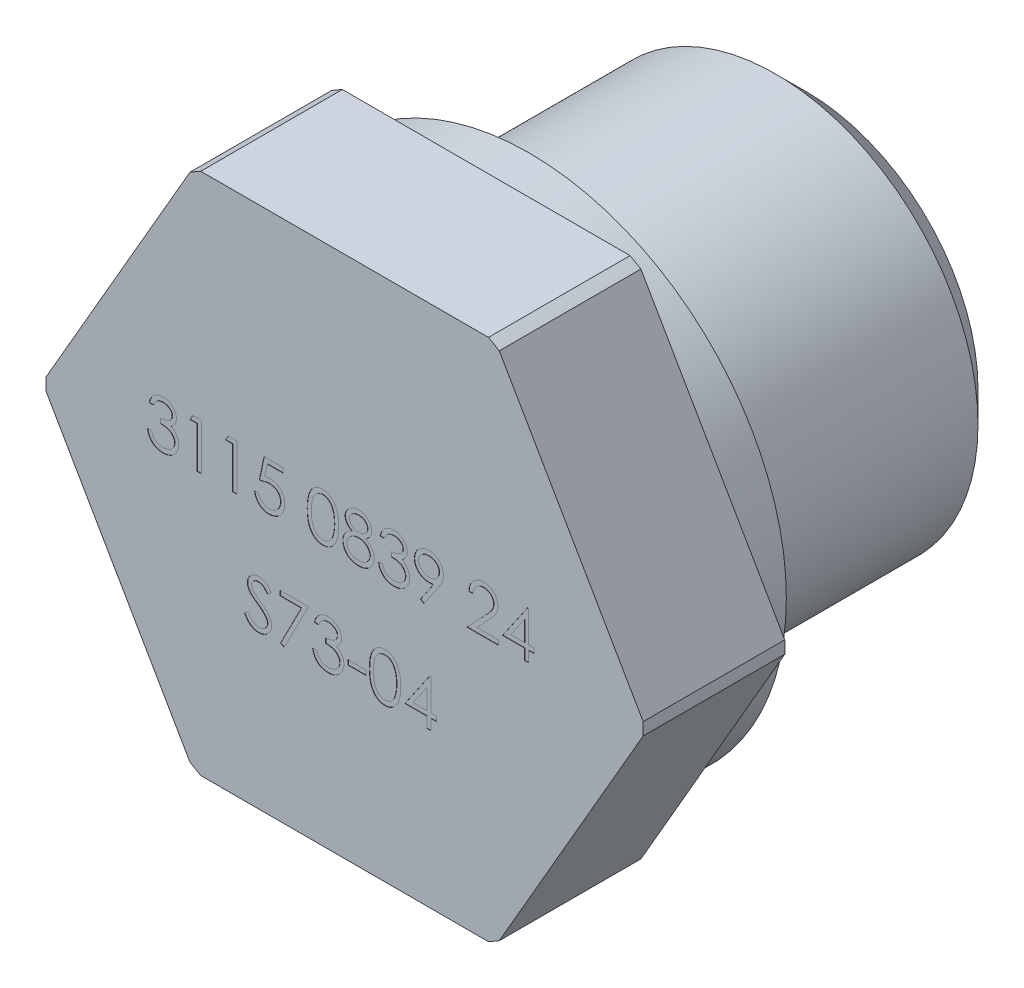
from build123d import *

# Parameters (mm, degrees)
SKETCH2_OUTSIDE_W  = 27.654
SKETCH2_OUTSIDE_H  = 27.654
CUT_EXTRUDE2_DEPTH = 15
SKETCH3_W          = 0.576923076
SKETCH3_H          = 0.153846154
CUT_EXTRUDE3_DEPTH = 0.01


with BuildPart() as part:
    # Sketch1 → Revolve1 (revolve)
    with BuildSketch(Plane(origin=(0, 0, 0), x_dir=(0, 0, -1), z_dir=(1, 0, 0)), mode=Mode.PRIVATE) as revolve1_sk:
        Polygon((15, 0), (15, 5.575), (14, 6.575), (6, 6.575), (6, 8.35), (4.6, 8.35), (4.6, 9.7), (0, 9.7), (0, 0), align=None)
    revolve(revolve1_sk.sketch.rotate(Axis((0, 0, 0), (0, 0, -1)), 90), axis=Axis((0, 0, 0), (0, 0, -1)))

    # Sketch2 outside → Cut-Extrude2 (cut)
    with BuildSketch(Plane.XY):
        Rectangle(SKETCH2_OUTSIDE_W, SKETCH2_OUTSIDE_H)
        Polygon((-4.907477288, 8.5), (-9.814954576, 0), (-4.907477288, -8.5), (4.907477288, -8.5), (9.814954576, 0), (4.907477288, 8.5), align=None, mode=Mode.SUBTRACT)
    extrude(amount=-CUT_EXTRUDE2_DEPTH, mode=Mode.SUBTRACT)

    # Sketch3 → Cut-Extrude3 (cut)
    # profile 1 of 16: a face of its own
    with BuildSketch(Plane.XY):
        with BuildLine():
            Line((-6.213744995, 1.153846154), (-6.34836038, 1.153846154))
            add(Edge.make_bspline(
                [(-6.34836038, 1.153846154), (-6.34471343, 1.16894579), (-6.33758394, 1.198464343), (-6.322713552, 1.240638884), (-6.306513871, 1.280548964), (-6.287061397, 1.317447281), (-6.26584336, 1.352075383), (-6.241533622, 1.383647864), (-6.215253741, 1.412967707), (-6.186185906, 1.438987666), (-6.155702193, 1.46254955), (-6.123373071, 1.48263886), (-6.089848973, 1.49992064), (-6.054897631, 1.514157882), (-6.018414986, 1.524883106), (-5.980730861, 1.532664595), (-5.941746504, 1.537717929), (-5.915283251, 1.538211113), (-5.901845957, 1.538461538)],
                knots=[0, 0, 0, 0, 1.162005537, 2.271625781, 3.343758855, 4.383309926, 5.390229558, 6.379919256, 7.361854164, 8.333198761, 9.295911338, 10.242430842, 11.177959212, 12.116337295, 13.062827104, 14.020064771, 14.994644689, 16, 16, 16, 16], degree=3))
            add(Edge.make_bspline(
                [(-5.901845957, 1.538461538), (-5.882267639, 1.53787044), (-5.843538063, 1.536701136), (-5.786639614, 1.52602352), (-5.731770977, 1.509127035), (-5.679532728, 1.485781152), (-5.631010543, 1.456986589), (-5.587837891, 1.422715988), (-5.550599958, 1.383630573), (-5.519359511, 1.340459474), (-5.494898797, 1.294321398), (-5.47686178, 1.246835617), (-5.465881059, 1.198114772), (-5.464457963, 1.165218795), (-5.463744995, 1.148737981)],
                knots=[0, 0, 0, 0, 1.083050992, 2.142477498, 3.193116406, 4.255571735, 5.30263384, 6.308962982, 7.297363603, 8.282367274, 9.249857812, 10.179914175, 11.08814088, 12, 12, 12, 12], degree=3))
            add(Edge.make_bspline(
                [(-5.463744995, 1.148737981), (-5.464243677, 1.132877926), (-5.46521952, 1.10184226), (-5.473505394, 1.056533047), (-5.487449507, 1.013829504), (-5.506765119, 0.973551863), (-5.531768641, 0.935955503), (-5.56205694, 0.900955835), (-5.597843795, 0.868397625), (-5.624963339, 0.849746422), (-5.638925284, 0.840144231)],
                knots=[0, 0, 0, 0, 1.024540389, 2.004866551, 2.965041327, 3.920577974, 4.882998113, 5.874504559, 6.905732034, 8, 8, 8, 8], degree=3))
            add(Edge.make_bspline(
                [(-5.638925284, 0.840144231), (-5.622968818, 0.8324393), (-5.591354443, 0.817173604), (-5.548261359, 0.787235422), (-5.509142269, 0.752668416), (-5.48732639, 0.725692994), (-5.476365188, 0.712139423)],
                knots=[0, 0, 0, 0, 1.015518401, 2.012035669, 3.001164323, 4, 4, 4, 4], degree=3))
            add(Edge.make_bspline(
                [(-5.476365188, 0.712139423), (-5.46914747, 0.70225753), (-5.454830228, 0.682655565), (-5.437157857, 0.651139954), (-5.421125379, 0.61927503), (-5.408632428, 0.586206713), (-5.398957914, 0.552318279), (-5.392042471, 0.517551538), (-5.387746411, 0.4818781), (-5.387131174, 0.457744179), (-5.386821918, 0.445612981)],
                knots=[0, 0, 0, 0, 1.025084078, 2.033381695, 3.024893161, 4.013698104, 4.991890475, 5.976764909, 6.982997093, 8, 8, 8, 8], degree=3))
            add(Edge.make_bspline(
                [(-5.386821918, 0.445612981), (-5.387590996, 0.424608815), (-5.389125531, 0.382699328), (-5.402841563, 0.32078159), (-5.42410438, 0.260256375), (-5.45430021, 0.202367158), (-5.491100571, 0.148204138), (-5.534882281, 0.099742862), (-5.585147885, 0.058086318), (-5.641207449, 0.023281934), (-5.701943361, -0.004540032), (-5.766904329, -0.023850365), (-5.835154352, -0.036427222), (-5.881957479, -0.03777588), (-5.905752207, -0.038461538)],
                knots=[0, 0, 0, 0, 0.955779014, 1.907060117, 2.875433937, 3.871313158, 4.872415639, 5.851225146, 6.836215519, 7.83643374, 8.849228613, 9.86973379, 10.916971861, 12, 12, 12, 12], degree=3))
            add(Edge.make_bspline(
                [(-5.905752207, -0.038461538), (-5.92178905, -0.038089447), (-5.953344209, -0.037357295), (-5.99973428, -0.03235218), (-6.044015008, -0.02321075), (-6.086246264, -0.010909333), (-6.126465566, 0.004687128), (-6.164550182, 0.024109427), (-6.200734422, 0.046957214), (-6.23467683, 0.07350018), (-6.266373359, 0.103192183), (-6.294981669, 0.13656033), (-6.320978724, 0.172987788), (-6.343668426, 0.21289767), (-6.364084263, 0.255774209), (-6.380876101, 0.302166422), (-6.395655631, 0.351659574), (-6.402527115, 0.386150034), (-6.406052688, 0.403846154)],
                knots=[0, 0, 0, 0, 1.048658725, 2.063410685, 3.046034179, 4.001477787, 4.936774919, 5.862367409, 6.792675028, 7.730719943, 8.675894397, 9.627829632, 10.600096036, 11.597688215, 12.626045268, 13.701542398, 14.82072376, 16, 16, 16, 16], degree=3))
            Line((-6.406052688, 0.403846154), (-6.271437303, 0.403846154))
            add(Edge.make_bspline(
                [(-6.271437303, 0.403846154), (-6.267930178, 0.392296577), (-6.261108516, 0.369831646), (-6.249496674, 0.337500086), (-6.236267414, 0.307860921), (-6.22207546, 0.280696726), (-6.207170412, 0.255739982), (-6.190492587, 0.233650609), (-6.173277239, 0.21345838), (-6.160300373, 0.202082118), (-6.153949322, 0.196514423)],
                knots=[0, 0, 0, 0, 1.198163088, 2.33053128, 3.407730985, 4.417276592, 5.372219308, 6.28897303, 7.162600585, 8, 8, 8, 8], degree=3))
            add(Edge.make_bspline(
                [(-6.153949322, 0.196514423), (-6.14555079, 0.190039423), (-6.128779648, 0.177109409), (-6.101450406, 0.160608711), (-6.072708312, 0.146311129), (-6.041930595, 0.135389545), (-6.009781407, 0.126141976), (-5.975741108, 0.120090325), (-5.940110015, 0.115938252), (-5.915780974, 0.115571852), (-5.903348361, 0.115384615)],
                knots=[0, 0, 0, 0, 0.946170439, 1.889420265, 2.845303464, 3.807233317, 4.801018734, 5.828864929, 6.890507805, 8, 8, 8, 8], degree=3))
            add(Edge.make_bspline(
                [(-5.903348361, 0.115384615), (-5.889311145, 0.115648575), (-5.861862582, 0.116164725), (-5.8218105, 0.120911456), (-5.783707308, 0.12782449), (-5.747976054, 0.138501483), (-5.714148694, 0.151693277), (-5.682699415, 0.168256879), (-5.65321537, 0.187690331), (-5.626074196, 0.209778542), (-5.601668979, 0.233959183), (-5.580180616, 0.259250499), (-5.561912904, 0.285545854), (-5.547177085, 0.312990763), (-5.535541134, 0.341471576), (-5.527619763, 0.371068217), (-5.522111971, 0.401538474), (-5.521663422, 0.422250889), (-5.521437303, 0.432692308)],
                knots=[0, 0, 0, 0, 1.217147791, 2.380027433, 3.494444702, 4.572153297, 5.609568379, 6.639424714, 7.649109417, 8.668170816, 9.669597737, 10.625200337, 11.543417969, 12.441394052, 13.322311151, 14.205496177, 15.095365482, 16, 16, 16, 16], degree=3))
            add(Edge.make_bspline(
                [(-5.521437303, 0.432692308), (-5.522093147, 0.446668596), (-5.52340157, 0.474551628), (-5.533390961, 0.515573445), (-5.549821903, 0.555097765), (-5.572824408, 0.592450247), (-5.600825435, 0.62706849), (-5.633553252, 0.657956268), (-5.671279635, 0.68344345), (-5.706002436, 0.701052874), (-5.736758932, 0.713068764), (-5.763079811, 0.72107232), (-5.792546927, 0.727849601), (-5.824803934, 0.73415486), (-5.860093883, 0.739521152), (-5.898378357, 0.743996216), (-5.939665112, 0.747576948), (-5.96824704, 0.749175989), (-5.982975765, 0.75)],
                knots=[0, 0, 0, 0, 1.07054697, 2.135767047, 3.216561865, 4.33974944, 5.486079747, 6.621378074, 7.775625952, 8.963672916, 9.598146892, 10.304877434, 11.070270905, 11.915000392, 12.823868403, 13.805723172, 14.86925407, 16, 16, 16, 16], degree=3))
            Line((-5.982975765, 0.75), (-5.982975765, 0.903846154))
            add(Edge.make_bspline(
                [(-5.982975765, 0.903846154), (-5.964418122, 0.90416107), (-5.928068259, 0.904777913), (-5.8749707, 0.912238488), (-5.824196424, 0.922558758), (-5.776870677, 0.938366697), (-5.733735514, 0.956726824), (-5.696312828, 0.978092057), (-5.665126907, 1.001841235), (-5.640329305, 1.028340925), (-5.621673921, 1.05676166), (-5.608033865, 1.086383084), (-5.599976583, 1.117464825), (-5.598901011, 1.138676825), (-5.59836038, 1.149338942)],
                knots=[0, 0, 0, 0, 1.321986639, 2.589447074, 3.816329219, 5.01088745, 6.139805852, 7.153945165, 8.075214402, 8.924034688, 9.728124013, 10.488707548, 11.240355623, 12, 12, 12, 12], degree=3))
            add(Edge.make_bspline(
                [(-5.59836038, 1.149338942), (-5.598537985, 1.157172262), (-5.598891321, 1.172756279), (-5.603347297, 1.195524166), (-5.610043315, 1.217596), (-5.619248913, 1.238877918), (-5.631570427, 1.259222321), (-5.646315849, 1.278802657), (-5.663873607, 1.297507133), (-5.683993084, 1.314941556), (-5.705598143, 1.331556943), (-5.729276618, 1.345662788), (-5.754314565, 1.357724957), (-5.780739702, 1.367671887), (-5.808637787, 1.375154439), (-5.83787774, 1.380526942), (-5.868515319, 1.383885937), (-5.88941749, 1.384369544), (-5.900043072, 1.384615385)],
                knots=[0, 0, 0, 0, 0.884392785, 1.759457502, 2.611959086, 3.489218968, 4.37281399, 5.2945488, 6.255912374, 7.266815255, 8.301784654, 9.332968512, 10.37626691, 11.440494194, 12.520033166, 13.637162961, 14.798855837, 16, 16, 16, 16], degree=3))
            add(Edge.make_bspline(
                [(-5.900043072, 1.384615385), (-5.917122359, 1.384019087), (-5.950482177, 1.382854378), (-5.998574284, 1.372653086), (-6.04328257, 1.356376765), (-6.077456285, 1.336948328), (-6.102691673, 1.317769571), (-6.120724647, 1.301019977), (-6.138433437, 1.282405909), (-6.154653013, 1.260780891), (-6.171056146, 1.23760941), (-6.185989529, 1.211713546), (-6.200500826, 1.183768806), (-6.209244776, 1.164013534), (-6.213744995, 1.153846154)],
                knots=[0, 0, 0, 0, 1.472543308, 2.876219568, 4.221790263, 5.565193594, 6.249813518, 6.953379497, 7.687249741, 8.463570142, 9.283606569, 10.136032583, 11.040678096, 12, 12, 12, 12], degree=3))
        make_face()
    # profile 2 of 16: a face of its own
    with BuildSketch(Plane.XY):
        Polygon((-4.933396438, 1.5), (-4.656052688, 1.5), (-4.656052688, 0), (-4.790668072, 0), (-4.790668072, 1.346153846), (-5.021437303, 1.346153846), align=None)
    # profile 3 of 16: a face of its own
    with BuildSketch(Plane.XY):
        Polygon((-3.779550284, 1.5), (-3.502206534, 1.5), (-3.502206534, 0), (-3.636821918, 0), (-3.636821918, 1.346153846), (-3.867591149, 1.346153846), align=None)
    # profile 4 of 16: a face of its own
    with BuildSketch(Plane.XY):
        with BuildLine():
            Line((-2.002206534, 1.5), (-2.002206534, 1.346153846))
            Line((-2.002206534, 1.346153846), (-2.512122399, 1.346153846))
            Line((-2.512122399, 1.346153846), (-2.593252207, 0.951622596))
            add(Edge.make_bspline(
                [(-2.593252207, 0.951622596), (-2.577371118, 0.956006998), (-2.54660402, 0.964501084), (-2.501192651, 0.973932129), (-2.458081706, 0.979617319), (-2.430106548, 0.980393595), (-2.416569515, 0.980769231)],
                knots=[0, 0, 0, 0, 1.100273476, 2.13160584, 3.095893838, 4, 4, 4, 4], degree=3))
            add(Edge.make_bspline(
                [(-2.416569515, 0.980769231), (-2.39981934, 0.980406687), (-2.366884313, 0.979693835), (-2.318696193, 0.972848757), (-2.272696382, 0.962074508), (-2.22898108, 0.947022855), (-2.187469415, 0.927775827), (-2.148543318, 0.903732995), (-2.111618498, 0.875647282), (-2.077357386, 0.843356563), (-2.04627554, 0.807818727), (-2.018947258, 0.769608211), (-1.99573472, 0.729096355), (-1.977065825, 0.685896095), (-1.962158253, 0.640485029), (-1.95223597, 0.592385351), (-1.945628809, 0.542050442), (-1.944890643, 0.507634198), (-1.944514226, 0.490084135)],
                knots=[0, 0, 0, 0, 1.052922333, 2.070308379, 3.05430497, 4.020497103, 4.973039431, 5.925935799, 6.892292201, 7.88610001, 8.88166317, 9.857072816, 10.836096531, 11.812156883, 12.81219415, 13.836441305, 14.89672472, 16, 16, 16, 16], degree=3))
            add(Edge.make_bspline(
                [(-1.944514226, 0.490084135), (-1.944799258, 0.477860326), (-1.945365471, 0.453577903), (-1.948244866, 0.417516102), (-1.953788744, 0.382217745), (-1.961232054, 0.347678149), (-1.970893091, 0.313962704), (-1.982588399, 0.280974906), (-1.996900983, 0.248920074), (-2.012600143, 0.217494905), (-2.030277205, 0.187409831), (-2.049896566, 0.159274551), (-2.070624633, 0.132667001), (-2.092928084, 0.107872544), (-2.117014225, 0.085054108), (-2.142591354, 0.064076273), (-2.169455376, 0.044584275), (-2.198021909, 0.027369334), (-2.227654401, 0.011528067), (-2.25878078, -0.001467735), (-2.290692509, -0.013086533), (-2.323848884, -0.022347759), (-2.358174804, -0.029604568), (-2.39372685, -0.034533397), (-2.430318566, -0.038123298), (-2.455122143, -0.038348023), (-2.467651245, -0.038461538)],
                knots=[0, 0, 0, 0, 1.056347294, 2.098418968, 3.122841568, 4.141288669, 5.149314143, 6.15115421, 7.162517403, 8.180376062, 9.185164535, 10.17417709, 11.141909838, 12.097768115, 13.052685741, 14.0056014, 14.954263652, 15.917497458, 16.885230207, 17.854509472, 18.828990115, 19.81800267, 20.826176721, 21.857883937, 22.917946725, 24, 24, 24, 24], degree=3))
            add(Edge.make_bspline(
                [(-2.467651245, -0.038461538), (-2.482597323, -0.038165465), (-2.512001965, -0.037582976), (-2.555082208, -0.031489339), (-2.596531324, -0.022761946), (-2.636015653, -0.009632116), (-2.673889052, 0.006819581), (-2.709641645, 0.027612226), (-2.744186978, 0.051174699), (-2.776120708, 0.078980565), (-2.805759042, 0.109373), (-2.832290403, 0.142354846), (-2.855919079, 0.17738175), (-2.876266685, 0.214623816), (-2.89362298, 0.253983186), (-2.907257975, 0.29560733), (-2.918262984, 0.33927876), (-2.922918736, 0.36934455), (-2.925283457, 0.384615385)],
                knots=[0, 0, 0, 0, 1.0467383, 2.05933395, 3.04377827, 4.011590433, 4.970194871, 5.932262533, 6.905835911, 7.896367577, 8.894135286, 9.877477877, 10.858688626, 11.851381753, 12.8477658, 13.868841284, 14.917554742, 16, 16, 16, 16], degree=3))
            Line((-2.925283457, 0.384615385), (-2.790668072, 0.384615385))
            add(Edge.make_bspline(
                [(-2.790668072, 0.384615385), (-2.787355833, 0.370311191), (-2.780989526, 0.342817736), (-2.767015634, 0.304190018), (-2.749930259, 0.269767494), (-2.72961411, 0.239094815), (-2.705378382, 0.212348102), (-2.677722913, 0.188512218), (-2.646716746, 0.167008591), (-2.612262504, 0.149084548), (-2.575914042, 0.13379794), (-2.537870952, 0.123618642), (-2.499169089, 0.116461116), (-2.472992645, 0.115744647), (-2.459838745, 0.115384615)],
                knots=[0, 0, 0, 0, 1.136247022, 2.183929868, 3.172523383, 4.106158343, 5.02341133, 5.958108904, 6.928429099, 7.938127109, 8.96079061, 9.975095812, 10.982467395, 12, 12, 12, 12], degree=3))
            add(Edge.make_bspline(
                [(-2.459838745, 0.115384615), (-2.446999412, 0.115736377), (-2.42171866, 0.116429), (-2.38451378, 0.121760005), (-2.348593976, 0.129970392), (-2.314313681, 0.142257473), (-2.281073021, 0.157190924), (-2.249712834, 0.176354528), (-2.219325886, 0.198408821), (-2.190856686, 0.223675949), (-2.164782636, 0.251520103), (-2.141744299, 0.281296129), (-2.122554193, 0.313060492), (-2.106382432, 0.346263272), (-2.094102447, 0.381268368), (-2.085342026, 0.417911728), (-2.080197858, 0.456283863), (-2.07949021, 0.482456424), (-2.079129611, 0.495793269)],
                knots=[0, 0, 0, 0, 1.027316725, 2.022795036, 3.002884548, 3.971462791, 4.93288096, 5.914575861, 6.907176829, 7.935150275, 8.956128384, 9.956726525, 10.942570165, 11.921478529, 12.907843606, 13.90538589, 14.932640048, 16, 16, 16, 16], degree=3))
            add(Edge.make_bspline(
                [(-2.079129611, 0.495793269), (-2.079411816, 0.507825734), (-2.079964193, 0.531377572), (-2.084477295, 0.565834375), (-2.092327426, 0.598437108), (-2.103223374, 0.629343208), (-2.117057449, 0.658581826), (-2.133963012, 0.686183137), (-2.154257325, 0.711783352), (-2.177439563, 0.735394446), (-2.202835866, 0.757185107), (-2.230883185, 0.775761144), (-2.260994582, 0.791388537), (-2.292807267, 0.804874822), (-2.327077938, 0.814560856), (-2.363127923, 0.821832807), (-2.401346512, 0.826039391), (-2.427476807, 0.826623057), (-2.440908457, 0.826923077)],
                knots=[0, 0, 0, 0, 1.045622112, 2.046656509, 3.013763289, 3.955457236, 4.890082067, 5.820317437, 6.762574623, 7.722996705, 8.69280354, 9.665887285, 10.63943826, 11.638615906, 12.663482002, 13.728887084, 14.832589034, 16, 16, 16, 16], degree=3))
            add(Edge.make_bspline(
                [(-2.440908457, 0.826923077), (-2.452535141, 0.826674252), (-2.476541293, 0.826160492), (-2.513365362, 0.822377708), (-2.552061814, 0.816275153), (-2.592482312, 0.807881047), (-2.634748244, 0.7968963), (-2.678770416, 0.783732942), (-2.724641388, 0.767994943), (-2.755548984, 0.756109708), (-2.771437303, 0.75)],
                knots=[0, 0, 0, 0, 0.817624296, 1.688186739, 2.600797293, 3.572016777, 4.590301741, 5.671205678, 6.80286297, 8, 8, 8, 8], degree=3))
            Line((-2.771437303, 0.75), (-2.617591149, 1.5))
            Line((-2.617591149, 1.5), (-2.002206534, 1.5))
        make_face()
    # profile 5 of 16: a face of its own
    with BuildSketch(Plane.XY):
        with BuildLine():
            add(Edge.make_bspline(
                [(-1.213744995, 0.749399038), (-1.213604416, 0.773440776), (-1.213331339, 0.820142198), (-1.210293444, 0.888192759), (-1.205246869, 0.952032883), (-1.198330852, 1.011665625), (-1.189914575, 1.067106381), (-1.178679366, 1.118206992), (-1.165902451, 1.165203966), (-1.15109426, 1.208250558), (-1.134385207, 1.247926717), (-1.116199096, 1.284966089), (-1.095814184, 1.319312631), (-1.074395507, 1.351514541), (-1.051076048, 1.381044696), (-1.026519423, 1.408320123), (-0.99976719, 1.432710444), (-0.971728758, 1.454930288), (-0.942150274, 1.474408633), (-0.911874845, 1.491565521), (-0.880694086, 1.506222607), (-0.848522864, 1.51774708), (-0.81565034, 1.527266014), (-0.781961597, 1.533775563), (-0.747401012, 1.537871381), (-0.724073254, 1.538262953), (-0.712242592, 1.538461538)],
                knots=[0, 0, 0, 0, 1.646270934, 3.197905019, 4.663502075, 6.030701355, 7.308322542, 8.50163776, 9.611534131, 10.641858119, 11.616356847, 12.558055219, 13.465016945, 14.349605745, 15.204443733, 16.039544428, 16.859896111, 17.680448484, 18.487036065, 19.28249412, 20.06191084, 20.843045899, 21.620316918, 22.403196591, 23.190181807, 24, 24, 24, 24], degree=3))
            add(Edge.make_bspline(
                [(-0.712242592, 1.538461538), (-0.700313101, 1.538252475), (-0.676589097, 1.537836713), (-0.64151465, 1.533840738), (-0.607250501, 1.527210256), (-0.573942727, 1.517815553), (-0.541317733, 1.506160263), (-0.509630701, 1.491551498), (-0.478684809, 1.47454627), (-0.448971829, 1.454564608), (-0.420165565, 1.432286489), (-0.392973581, 1.407102489), (-0.367393401, 1.379266895), (-0.343103985, 1.349077524), (-0.320794443, 1.315955345), (-0.299548686, 1.280476441), (-0.2805321, 1.242020356), (-0.262217239, 1.201228727), (-0.24640853, 1.156972873), (-0.232151568, 1.109502262), (-0.22063201, 1.058256181), (-0.211036608, 1.003503505), (-0.203603081, 0.945043155), (-0.198189091, 0.883000448), (-0.195329198, 0.817334567), (-0.194790611, 0.772438346), (-0.194514226, 0.749399038)],
                knots=[0, 0, 0, 0, 0.810914788, 1.612654377, 2.396697861, 3.181598691, 3.963628158, 4.749916497, 5.551656086, 6.361998678, 7.18212741, 8.025565596, 8.878627764, 9.750805457, 10.657531673, 11.591944965, 12.560506719, 13.57287815, 14.630710178, 15.753379473, 16.941251878, 18.199788006, 19.531962791, 20.947069417, 22.433333509, 24, 24, 24, 24], degree=3))
            add(Edge.make_bspline(
                [(-0.194514226, 0.749399038), (-0.194793477, 0.726460221), (-0.195337585, 0.68176487), (-0.198157031, 0.616394452), (-0.20371073, 0.554681005), (-0.210657868, 0.496476521), (-0.220279709, 0.442023256), (-0.232110494, 0.391132778), (-0.245246347, 0.343585319), (-0.261461259, 0.299770399), (-0.279208706, 0.259076804), (-0.298518076, 0.221076597), (-0.319205144, 0.1854339), (-0.341743178, 0.152434009), (-0.365766069, 0.121843156), (-0.391787979, 0.094201318), (-0.419075372, 0.068842458), (-0.447966408, 0.046277475), (-0.478142787, 0.026526844), (-0.508982391, 0.008863766), (-0.541032413, -0.005378818), (-0.573566535, -0.017608121), (-0.607050121, -0.026951172), (-0.641441431, -0.033411396), (-0.676565532, -0.037942188), (-0.70030906, -0.038287822), (-0.712242592, -0.038461538)],
                knots=[0, 0, 0, 0, 1.561518951, 3.042555995, 4.452378317, 5.7783523, 7.031515105, 8.214008947, 9.334062868, 10.386615937, 11.391082383, 12.354592575, 13.286541444, 14.194233754, 15.072674879, 15.931287219, 16.775624067, 17.606195743, 18.42308326, 19.229000347, 20.022332153, 20.807536673, 21.593273796, 22.3848459, 23.188221202, 24, 24, 24, 24], degree=3))
            add(Edge.make_bspline(
                [(-0.712242592, -0.038461538), (-0.724072926, -0.038261672), (-0.747400037, -0.037867574), (-0.781965362, -0.03379026), (-0.815514981, -0.027235045), (-0.848214447, -0.0180565), (-0.880231524, -0.00682157), (-0.911129933, 0.007815723), (-0.941253226, 0.024673181), (-0.970521036, 0.043871219), (-0.99838339, 0.065866226), (-1.024997078, 0.090193778), (-1.049693515, 0.117460954), (-1.072679556, 0.147237207), (-1.094525594, 0.179248597), (-1.11462104, 0.213932185), (-1.133208549, 0.251150447), (-1.150198616, 0.291143837), (-1.165262329, 0.334495949), (-1.17856849, 0.38170274), (-1.189074557, 0.433180869), (-1.198067252, 0.488516884), (-1.205320559, 0.547948568), (-1.210272413, 0.611508188), (-1.213332977, 0.679156134), (-1.21360515, 0.725557466), (-1.213744995, 0.749399038)],
                knots=[0, 0, 0, 0, 0.810891512, 1.598919785, 2.382837074, 3.152667961, 3.926044502, 4.706494248, 5.493654104, 6.291793342, 7.103789334, 7.925228297, 8.761435821, 9.622817696, 10.50288917, 11.416980706, 12.369136599, 13.353924996, 14.394355917, 15.514179734, 16.714354668, 17.994756427, 19.357759367, 20.818452758, 22.365282078, 24, 24, 24, 24], degree=3))
        make_face()
        with BuildLine():
            add(Edge.make_bspline(
                [(-1.079129611, 0.75), (-1.079078419, 0.729964843), (-1.078979066, 0.691080538), (-1.076383552, 0.634576284), (-1.072847738, 0.581874714), (-1.068287182, 0.532908913), (-1.06151449, 0.487844622), (-1.053925867, 0.446371901), (-1.044690971, 0.408710227), (-1.033764535, 0.374601166), (-1.021319208, 0.343465851), (-1.00773098, 0.314493901), (-0.993133528, 0.287343071), (-0.976796749, 0.262257239), (-0.959004579, 0.239154598), (-0.940158896, 0.217626241), (-0.91955636, 0.198427535), (-0.891054756, 0.17540174), (-0.853427696, 0.151607825), (-0.806018929, 0.130888072), (-0.757303879, 0.11786702), (-0.724239057, 0.116211124), (-0.70773538, 0.115384615)],
                knots=[0, 0, 0, 0, 1.459021318, 2.831673884, 4.118529203, 5.306027144, 6.411944654, 7.436330062, 8.375795394, 9.233974572, 10.042671642, 10.816086306, 11.563610507, 12.285937304, 12.993564865, 13.685989202, 14.367179055, 15.041617293, 16.353048772, 17.594441528, 18.799311195, 20, 20, 20, 20], degree=3))
            add(Edge.make_bspline(
                [(-0.70773538, 0.115384615), (-0.691124949, 0.116069379), (-0.657938382, 0.117437491), (-0.60945247, 0.13063695), (-0.562382354, 0.150552467), (-0.52549438, 0.174101398), (-0.497430433, 0.196527825), (-0.477323151, 0.215648388), (-0.458867988, 0.237058046), (-0.441364241, 0.260157744), (-0.425310352, 0.285388809), (-0.410711864, 0.312629912), (-0.397390429, 0.341956703), (-0.389800838, 0.362429448), (-0.385920476, 0.372896635)],
                knots=[0, 0, 0, 0, 1.353760809, 2.704726607, 4.075137775, 5.516104923, 6.260822281, 7.007110065, 7.778089737, 8.566572457, 9.372053459, 10.217411131, 11.088608312, 12, 12, 12, 12], degree=3))
            add(Edge.make_bspline(
                [(-0.385920476, 0.372896635), (-0.38139829, 0.386280809), (-0.372216313, 0.413456422), (-0.360382695, 0.455612273), (-0.351063238, 0.499842029), (-0.342678939, 0.545881365), (-0.3369562, 0.594069808), (-0.332349995, 0.644258258), (-0.329636843, 0.696484556), (-0.329300521, 0.731968124), (-0.329129611, 0.75)],
                knots=[0, 0, 0, 0, 0.884706709, 1.796334032, 2.740027952, 3.714592787, 4.726048262, 5.777819803, 6.87074269, 8, 8, 8, 8], degree=3))
            add(Edge.make_bspline(
                [(-0.329129611, 0.75), (-0.329365406, 0.76802896), (-0.329826672, 0.803297459), (-0.33158981, 0.854948108), (-0.33614277, 0.90400572), (-0.341199536, 0.950681636), (-0.348655488, 0.99471748), (-0.356694548, 1.036481897), (-0.367495067, 1.075457479), (-0.379032114, 1.112254443), (-0.392236569, 1.146454723), (-0.406771884, 1.178217774), (-0.422295494, 1.207696942), (-0.439156455, 1.234811346), (-0.457154605, 1.259682435), (-0.476764983, 1.281811547), (-0.497209714, 1.301884534), (-0.525845651, 1.324797063), (-0.563334632, 1.348159219), (-0.609982767, 1.36965883), (-0.658527328, 1.382005241), (-0.691344523, 1.383745964), (-0.70773538, 1.384615385)],
                knots=[0, 0, 0, 0, 1.31362396, 2.569729283, 3.763502607, 4.902122613, 5.988968491, 7.01645872, 7.998833611, 8.933434873, 9.825090667, 10.667526885, 11.477055099, 12.250526234, 12.991942729, 13.710640831, 14.402115721, 15.076753259, 16.378508321, 17.609869233, 18.806226677, 20, 20, 20, 20], degree=3))
            add(Edge.make_bspline(
                [(-0.70773538, 1.384615385), (-0.724325634, 1.383744765), (-0.757536365, 1.382001939), (-0.806585488, 1.36970483), (-0.853601639, 1.348270702), (-0.890991485, 1.324719685), (-0.919647394, 1.30228898), (-0.939825691, 1.282837643), (-0.958745479, 1.261560676), (-0.976174493, 1.23824557), (-0.992498472, 1.213188984), (-1.007490334, 1.186193799), (-1.020997761, 1.157123214), (-1.033462563, 1.126001885), (-1.044422329, 1.091895766), (-1.053462599, 1.054280483), (-1.061814193, 1.012939672), (-1.067726451, 0.967631312), (-1.072982346, 0.918653246), (-1.076360067, 0.86582011), (-1.078987749, 0.809221089), (-1.079081376, 0.770135736), (-1.079129611, 0.75)],
                knots=[0, 0, 0, 0, 1.207732386, 2.417664972, 3.655092373, 4.956220595, 5.625982001, 6.301752483, 6.994047911, 7.697131622, 8.419323945, 9.170223765, 9.943494443, 10.752040957, 11.610060368, 12.549350801, 13.567764191, 14.679664412, 15.874934091, 17.154273443, 18.533957287, 20, 20, 20, 20], degree=3))
        make_face(mode=Mode.SUBTRACT)
    # profile 6 of 16: a face of its own
    with BuildSketch(Plane.XY):
        with BuildLine():
            add(Edge.make_bspline(
                [(0.669367985, 0.835637019), (0.681645934, 0.829235038), (0.705592035, 0.816749037), (0.739696553, 0.796644396), (0.77086441, 0.775455411), (0.799960365, 0.7541829), (0.82647323, 0.732012193), (0.85010655, 0.708855126), (0.871444101, 0.68528972), (0.89005558, 0.660916932), (0.906425653, 0.635801511), (0.920573711, 0.609877537), (0.932666798, 0.583201822), (0.942250914, 0.555483181), (0.950145968, 0.527128783), (0.95557837, 0.497772505), (0.958499906, 0.467607787), (0.959052255, 0.447221372), (0.959331928, 0.436899038)],
                knots=[0, 0, 0, 0, 1.272397273, 2.481599622, 3.635517121, 4.734568067, 5.792894095, 6.808321871, 7.773003508, 8.711915296, 9.623354172, 10.525449501, 11.423591555, 12.311487226, 13.218079475, 14.126165749, 15.051214107, 16, 16, 16, 16], degree=3))
            add(Edge.make_bspline(
                [(0.959331928, 0.436899038), (0.959001319, 0.422457153), (0.95834692, 0.393871243), (0.952646927, 0.351680052), (0.944112793, 0.310703574), (0.931650145, 0.270950793), (0.915487263, 0.232641061), (0.895568619, 0.195741587), (0.87302096, 0.159647597), (0.854912857, 0.137439282), (0.845750197, 0.126201923)],
                knots=[0, 0, 0, 0, 1.025265484, 2.029385089, 3.018602448, 3.995076438, 4.983346944, 5.966715145, 6.97116228, 8, 8, 8, 8], degree=3))
            add(Edge.make_bspline(
                [(0.845750197, 0.126201923), (0.833820279, 0.113090306), (0.810107866, 0.087029094), (0.769486611, 0.053193033), (0.724905803, 0.024757578), (0.676537947, 0.001583909), (0.624512332, -0.016452887), (0.568840044, -0.029413966), (0.50941255, -0.036837865), (0.468567348, -0.037911003), (0.447613178, -0.038461538)],
                knots=[0, 0, 0, 0, 0.954267603, 1.896743057, 2.838368354, 3.796610408, 4.779680527, 5.799409237, 6.871065594, 8, 8, 8, 8], degree=3))
            add(Edge.make_bspline(
                [(0.447613178, -0.038461538), (0.427464583, -0.037967619), (0.388257463, -0.037006503), (0.331189801, -0.030494604), (0.2779942, -0.019082661), (0.228361356, -0.003463543), (0.182590488, 0.016855127), (0.140812016, 0.042144445), (0.102423171, 0.071386491), (0.068588968, 0.105421096), (0.038551063, 0.14187447), (0.012164755, 0.179482303), (-0.009766993, 0.218248028), (-0.028335748, 0.257593614), (-0.042550615, 0.298070537), (-0.052395848, 0.339470542), (-0.058648412, 0.381721318), (-0.059480326, 0.410234884), (-0.059898842, 0.424579327)],
                knots=[0, 0, 0, 0, 1.256902934, 2.445805442, 3.576955095, 4.645999104, 5.686449165, 6.692658513, 7.68621702, 8.689161843, 9.678783111, 10.630372946, 11.551080876, 12.453998257, 13.34127905, 14.221779781, 15.105423033, 16, 16, 16, 16], degree=3))
            add(Edge.make_bspline(
                [(-0.059898842, 0.424579327), (-0.059651178, 0.435104695), (-0.059161708, 0.455906537), (-0.055773916, 0.486639106), (-0.050327433, 0.516551736), (-0.042930523, 0.545754911), (-0.032905797, 0.574036028), (-0.020802026, 0.601529088), (-0.006688332, 0.628265131), (0.009632168, 0.654390366), (0.028618749, 0.679538728), (0.050117456, 0.704137011), (0.074557972, 0.727803526), (0.101668397, 0.750827422), (0.131138914, 0.773617125), (0.163734998, 0.794941009), (0.198592542, 0.816308708), (0.223366287, 0.829083705), (0.236074716, 0.835637019)],
                knots=[0, 0, 0, 0, 0.941657376, 1.861047343, 2.762797495, 3.66048619, 4.553285746, 5.444104102, 6.34607688, 7.256116206, 8.197091036, 9.162375105, 10.176350973, 11.237807142, 12.343728897, 13.50695164, 14.721116704, 16, 16, 16, 16], degree=3))
            add(Edge.make_bspline(
                [(0.236074716, 0.835637019), (0.218678413, 0.845123349), (0.1849943, 0.863491538), (0.140393111, 0.897240169), (0.102082844, 0.933792089), (0.071116536, 0.973919144), (0.046742724, 1.016367805), (0.030020465, 1.060872484), (0.018707686, 1.106607962), (0.017587046, 1.137853474), (0.017024235, 1.153545673)],
                knots=[0, 0, 0, 0, 1.166880483, 2.259407225, 3.286803203, 4.280235371, 5.237608625, 6.161067461, 7.076446754, 8, 8, 8, 8], degree=3))
            add(Edge.make_bspline(
                [(0.017024235, 1.153545673), (0.017725131, 1.169530341), (0.019134055, 1.201662311), (0.030526906, 1.249493507), (0.049092649, 1.296472035), (0.074344505, 1.342370197), (0.105796169, 1.385634575), (0.143530403, 1.424437838), (0.186646102, 1.458428473), (0.234928045, 1.486961118), (0.286886431, 1.510182687), (0.341707456, 1.526202011), (0.398435953, 1.536674632), (0.437049261, 1.537860341), (0.456627601, 1.538461538)],
                knots=[0, 0, 0, 0, 0.888701115, 1.786444228, 2.72001202, 3.692817113, 4.693886446, 5.687152267, 6.695133018, 7.739871481, 8.800368666, 9.853104506, 10.91144658, 12, 12, 12, 12], degree=3))
            add(Edge.make_bspline(
                [(0.456627601, 1.538461538), (0.475700664, 1.537841677), (0.513310573, 1.536619381), (0.568593985, 1.526425005), (0.621490361, 1.509398068), (0.671817289, 1.486299258), (0.718673803, 1.457847712), (0.760074793, 1.423390194), (0.7966459, 1.384758101), (0.826896354, 1.341506843), (0.851823307, 1.295785045), (0.869180836, 1.247946822), (0.880303111, 1.199025797), (0.881705981, 1.165923795), (0.882408851, 1.149338942)],
                knots=[0, 0, 0, 0, 1.072916533, 2.115669174, 3.151510826, 4.193348718, 5.225979165, 6.227137561, 7.216255879, 8.211077061, 9.189680878, 10.138522389, 11.067357538, 12, 12, 12, 12], degree=3))
            add(Edge.make_bspline(
                [(0.882408851, 1.149338942), (0.881794039, 1.133063229), (0.880586584, 1.101098654), (0.870429467, 1.054501574), (0.853323761, 1.010863557), (0.82996912, 0.969689435), (0.799529625, 0.931725936), (0.762411597, 0.896490306), (0.718910963, 0.863693093), (0.686227726, 0.845184652), (0.669367985, 0.835637019)],
                knots=[0, 0, 0, 0, 0.975232327, 1.915300861, 2.843280834, 3.77672583, 4.742871857, 5.749627742, 6.839139064, 8, 8, 8, 8], degree=3))
        make_face()
        with BuildLine():
            add(Edge.make_bspline(
                [(0.449115582, 1.384615385), (0.438593808, 1.384336196), (0.418008617, 1.38378998), (0.387824901, 1.380936279), (0.359122458, 1.3753849), (0.3316014, 1.367996881), (0.305639052, 1.358016315), (0.280882815, 1.346275596), (0.257754019, 1.332001568), (0.235973461, 1.315989626), (0.216365986, 1.298378381), (0.198964035, 1.280029644), (0.184509129, 1.260583048), (0.172234368, 1.240522322), (0.163328003, 1.219252075), (0.156657587, 1.197424428), (0.152148419, 1.174763549), (0.151810538, 1.159276473), (0.15163962, 1.151442308)],
                knots=[0, 0, 0, 0, 1.203892937, 2.355340988, 3.463153438, 4.544400666, 5.610487187, 6.640501085, 7.674077295, 8.714426146, 9.728707835, 10.68524104, 11.601827946, 12.495867327, 13.368432065, 14.231010473, 15.105153427, 16, 16, 16, 16], degree=3))
            add(Edge.make_bspline(
                [(0.15163962, 1.151442308), (0.151934206, 1.143607804), (0.15251635, 1.128125698), (0.157018547, 1.105263184), (0.163728628, 1.082796768), (0.174293197, 1.061260664), (0.186964494, 1.039907795), (0.202603698, 1.01927183), (0.221241853, 0.999280951), (0.242253613, 0.98010519), (0.265144272, 0.962148577), (0.289394576, 0.946560071), (0.314700172, 0.933516881), (0.340801059, 0.922661422), (0.367963251, 0.914222877), (0.396020311, 0.908236314), (0.424976955, 0.904515459), (0.444597204, 0.904071021), (0.454524235, 0.903846154)],
                knots=[0, 0, 0, 0, 0.873023192, 1.725219244, 2.590779336, 3.480155217, 4.391973325, 5.357036234, 6.360879153, 7.436073238, 8.526419356, 9.601555421, 10.645666583, 11.697338044, 12.750135903, 13.812665442, 14.89329948, 16, 16, 16, 16], degree=3))
            add(Edge.make_bspline(
                [(0.454524235, 0.903846154), (0.46727428, 0.90422024), (0.492648437, 0.904964717), (0.530053865, 0.911886648), (0.56642357, 0.922774899), (0.601368815, 0.937672027), (0.633985066, 0.956369681), (0.663059381, 0.978755261), (0.688343763, 1.004311874), (0.709575453, 1.03264166), (0.726036816, 1.062792341), (0.738851876, 1.09304961), (0.746335255, 1.12373628), (0.747311355, 1.14429355), (0.747793466, 1.154447115)],
                knots=[0, 0, 0, 0, 1.076279235, 2.141928126, 3.20205304, 4.278698113, 5.344010996, 6.36967002, 7.368914609, 8.37248503, 9.349703398, 10.264243087, 11.142681841, 12, 12, 12, 12], degree=3))
            add(Edge.make_bspline(
                [(0.747793466, 1.154447115), (0.74756551, 1.161573416), (0.74711305, 1.175718103), (0.743384454, 1.196605974), (0.737223383, 1.217018652), (0.728882063, 1.237124768), (0.717906437, 1.256642225), (0.704893214, 1.275877834), (0.68908557, 1.294398876), (0.671344242, 1.312636968), (0.651224781, 1.329515835), (0.628765961, 1.344359282), (0.604082925, 1.356964578), (0.57717509, 1.367202616), (0.548141551, 1.374892194), (0.517116033, 1.380650629), (0.483839841, 1.383896248), (0.460941377, 1.384370473), (0.449115582, 1.384615385)],
                knots=[0, 0, 0, 0, 0.814439003, 1.616544685, 2.417341072, 3.248991801, 4.09997495, 4.973547432, 5.9003056, 6.880240646, 7.880314356, 8.896779544, 9.951930927, 11.043077905, 12.18215768, 13.381699519, 14.647792085, 16, 16, 16, 16], degree=3))
        make_face(mode=Mode.SUBTRACT)
        with BuildLine():
            add(Edge.make_bspline(
                [(0.457829524, 0.75), (0.444489901, 0.749762725), (0.418320817, 0.74929725), (0.379982134, 0.744116035), (0.34318792, 0.736903438), (0.308062233, 0.72596165), (0.274619906, 0.711734583), (0.242679899, 0.69461978), (0.212486558, 0.674388876), (0.184456818, 0.651298898), (0.158861105, 0.626416275), (0.136404691, 0.60007536), (0.117334325, 0.572765703), (0.101977217, 0.544140462), (0.089372189, 0.514805771), (0.081094813, 0.484031088), (0.075788366, 0.452408039), (0.075075809, 0.430910854), (0.074716543, 0.420072115)],
                knots=[0, 0, 0, 0, 1.140299081, 2.23698856, 3.303958914, 4.344563908, 5.37730929, 6.408454204, 7.439741482, 8.480804886, 9.510774543, 10.48932336, 11.43758569, 12.353841022, 13.263987381, 14.161954604, 15.073269652, 16, 16, 16, 16], degree=3))
            add(Edge.make_bspline(
                [(0.074716543, 0.420072115), (0.075300797, 0.406601727), (0.076459943, 0.379876791), (0.085655645, 0.340378332), (0.100413732, 0.302140737), (0.120995967, 0.265475615), (0.14648207, 0.231211283), (0.177821984, 0.201344665), (0.213068058, 0.174806889), (0.253412852, 0.153343803), (0.297482195, 0.136203151), (0.345264364, 0.124393453), (0.396073615, 0.116575688), (0.431156298, 0.115787896), (0.449115582, 0.115384615)],
                knots=[0, 0, 0, 0, 0.898778495, 1.783155532, 2.693654817, 3.627872908, 4.583023416, 5.533784346, 6.509005473, 7.520592997, 8.575161974, 9.658835044, 10.801527049, 12, 12, 12, 12], degree=3))
            add(Edge.make_bspline(
                [(0.449115582, 0.115384615), (0.463151453, 0.115654105), (0.490497833, 0.116179156), (0.530391811, 0.120813854), (0.568039475, 0.128163693), (0.603367817, 0.138853784), (0.63677232, 0.151903774), (0.667686614, 0.168691809), (0.696905983, 0.187785662), (0.722990607, 0.210439157), (0.746747697, 0.234644655), (0.767461965, 0.260268959), (0.785443772, 0.286615659), (0.799557039, 0.314280152), (0.810839719, 0.342731687), (0.818949814, 0.372232621), (0.823953907, 0.402873435), (0.824460005, 0.423658751), (0.824716543, 0.434194712)],
                knots=[0, 0, 0, 0, 1.224942928, 2.386581632, 3.501229538, 4.569074225, 5.605009692, 6.626002462, 7.634866581, 8.645888296, 9.63523824, 10.59253846, 11.518950513, 12.414518923, 13.29783783, 14.186679152, 15.080837789, 16, 16, 16, 16], degree=3))
            add(Edge.make_bspline(
                [(0.824716543, 0.434194712), (0.824328322, 0.444427858), (0.823562819, 0.464605834), (0.818704237, 0.494505774), (0.810168861, 0.523392694), (0.798457119, 0.551614125), (0.782865278, 0.578598247), (0.764503191, 0.605048035), (0.742348569, 0.630229368), (0.717314599, 0.654337838), (0.690032187, 0.676630296), (0.661031982, 0.69635077), (0.630537213, 0.71295882), (0.598612408, 0.726465889), (0.565328456, 0.737089091), (0.530709836, 0.744510231), (0.494716018, 0.74918149), (0.470263931, 0.749724081), (0.457829524, 0.75)],
                knots=[0, 0, 0, 0, 0.917430815, 1.809013306, 2.70690318, 3.612392954, 4.541220862, 5.495268465, 6.494511384, 7.542276156, 8.608045339, 9.649016899, 10.681629292, 11.715607085, 12.752076957, 13.808767841, 14.885711793, 16, 16, 16, 16], degree=3))
        make_face(mode=Mode.SUBTRACT)
    # profile 7 of 16: a face of its own
    with BuildSketch(Plane.XY):
        with BuildLine():
            Line((1.286255005, 1.153846154), (1.15163962, 1.153846154))
            add(Edge.make_bspline(
                [(1.15163962, 1.153846154), (1.15528657, 1.16894579), (1.16241606, 1.198464343), (1.177286448, 1.240638884), (1.193486129, 1.280548964), (1.212938603, 1.317447281), (1.23415664, 1.352075383), (1.258466378, 1.383647864), (1.284746259, 1.412967707), (1.313814094, 1.438987666), (1.344297807, 1.46254955), (1.376626929, 1.48263886), (1.410151027, 1.49992064), (1.445102369, 1.514157882), (1.481585014, 1.524883106), (1.519269139, 1.532664595), (1.558253496, 1.537717929), (1.584716749, 1.538211113), (1.598154043, 1.538461538)],
                knots=[0, 0, 0, 0, 1.162005537, 2.271625781, 3.343758855, 4.383309926, 5.390229558, 6.379919256, 7.361854164, 8.333198761, 9.295911338, 10.242430842, 11.177959212, 12.116337295, 13.062827104, 14.020064771, 14.994644689, 16, 16, 16, 16], degree=3))
            add(Edge.make_bspline(
                [(1.598154043, 1.538461538), (1.617732361, 1.53787044), (1.656461937, 1.536701136), (1.713360386, 1.52602352), (1.768229023, 1.509127035), (1.820467272, 1.485781152), (1.868989457, 1.456986589), (1.912162109, 1.422715988), (1.949400042, 1.383630573), (1.980640489, 1.340459474), (2.005101203, 1.294321398), (2.02313822, 1.246835617), (2.034118941, 1.198114772), (2.035542037, 1.165218795), (2.036255005, 1.148737981)],
                knots=[0, 0, 0, 0, 1.083050992, 2.142477498, 3.193116406, 4.255571735, 5.30263384, 6.308962982, 7.297363603, 8.282367274, 9.249857812, 10.179914175, 11.08814088, 12, 12, 12, 12], degree=3))
            add(Edge.make_bspline(
                [(2.036255005, 1.148737981), (2.035756323, 1.132877926), (2.03478048, 1.10184226), (2.026494606, 1.056533047), (2.012550493, 1.013829504), (1.993234881, 0.973551863), (1.968231359, 0.935955503), (1.93794306, 0.900955835), (1.902156205, 0.868397625), (1.875036661, 0.849746422), (1.861074716, 0.840144231)],
                knots=[0, 0, 0, 0, 1.024540389, 2.004866551, 2.965041327, 3.920577974, 4.882998113, 5.874504559, 6.905732034, 8, 8, 8, 8], degree=3))
            add(Edge.make_bspline(
                [(1.861074716, 0.840144231), (1.877031182, 0.8324393), (1.908645557, 0.817173604), (1.951738641, 0.787235422), (1.990857731, 0.752668416), (2.01267361, 0.725692994), (2.023634812, 0.712139423)],
                knots=[0, 0, 0, 0, 1.015518401, 2.012035669, 3.001164323, 4, 4, 4, 4], degree=3))
            add(Edge.make_bspline(
                [(2.023634812, 0.712139423), (2.03085253, 0.70225753), (2.045169772, 0.682655565), (2.062842143, 0.651139954), (2.078874621, 0.61927503), (2.091367572, 0.586206713), (2.101042086, 0.552318279), (2.107957529, 0.517551538), (2.112253589, 0.4818781), (2.112868826, 0.457744179), (2.113178082, 0.445612981)],
                knots=[0, 0, 0, 0, 1.025084078, 2.033381695, 3.024893161, 4.013698104, 4.991890475, 5.976764909, 6.982997093, 8, 8, 8, 8], degree=3))
            add(Edge.make_bspline(
                [(2.113178082, 0.445612981), (2.112409004, 0.424608815), (2.110874469, 0.382699328), (2.097158437, 0.32078159), (2.07589562, 0.260256375), (2.04569979, 0.202367158), (2.008899429, 0.148204138), (1.965117719, 0.099742862), (1.914852115, 0.058086318), (1.858792551, 0.023281934), (1.798056639, -0.004540032), (1.733095671, -0.023850365), (1.664845648, -0.036427222), (1.618042521, -0.03777588), (1.594247793, -0.038461538)],
                knots=[0, 0, 0, 0, 0.955779014, 1.907060117, 2.875433937, 3.871313158, 4.872415639, 5.851225146, 6.836215519, 7.83643374, 8.849228613, 9.86973379, 10.916971861, 12, 12, 12, 12], degree=3))
            add(Edge.make_bspline(
                [(1.594247793, -0.038461538), (1.57821095, -0.038089447), (1.546655791, -0.037357295), (1.50026572, -0.03235218), (1.455984992, -0.02321075), (1.413753736, -0.010909333), (1.373534434, 0.004687128), (1.335449818, 0.024109427), (1.299265578, 0.046957214), (1.26532317, 0.07350018), (1.233626641, 0.103192183), (1.205018331, 0.13656033), (1.179021276, 0.172987788), (1.156331574, 0.21289767), (1.135915737, 0.255774209), (1.119123899, 0.302166422), (1.104344369, 0.351659574), (1.097472885, 0.386150034), (1.093947312, 0.403846154)],
                knots=[0, 0, 0, 0, 1.048658725, 2.063410685, 3.046034179, 4.001477787, 4.936774919, 5.862367409, 6.792675028, 7.730719943, 8.675894397, 9.627829632, 10.600096036, 11.597688215, 12.626045268, 13.701542398, 14.82072376, 16, 16, 16, 16], degree=3))
            Line((1.093947312, 0.403846154), (1.228562697, 0.403846154))
            add(Edge.make_bspline(
                [(1.228562697, 0.403846154), (1.232069822, 0.392296577), (1.238891484, 0.369831646), (1.250503326, 0.337500086), (1.263732586, 0.307860921), (1.27792454, 0.280696726), (1.292829588, 0.255739982), (1.309507413, 0.233650609), (1.326722761, 0.21345838), (1.339699627, 0.202082118), (1.346050678, 0.196514423)],
                knots=[0, 0, 0, 0, 1.198163088, 2.33053128, 3.407730985, 4.417276592, 5.372219308, 6.28897303, 7.162600585, 8, 8, 8, 8], degree=3))
            add(Edge.make_bspline(
                [(1.346050678, 0.196514423), (1.35444921, 0.190039423), (1.371220352, 0.177109409), (1.398549594, 0.160608711), (1.427291688, 0.146311129), (1.458069405, 0.135389545), (1.490218593, 0.126141976), (1.524258892, 0.120090325), (1.559889985, 0.115938252), (1.584219026, 0.115571852), (1.596651639, 0.115384615)],
                knots=[0, 0, 0, 0, 0.946170439, 1.889420265, 2.845303464, 3.807233317, 4.801018734, 5.828864929, 6.890507805, 8, 8, 8, 8], degree=3))
            add(Edge.make_bspline(
                [(1.596651639, 0.115384615), (1.610688855, 0.115648575), (1.638137418, 0.116164725), (1.6781895, 0.120911456), (1.716292692, 0.12782449), (1.752023946, 0.138501483), (1.785851306, 0.151693277), (1.817300585, 0.168256879), (1.84678463, 0.187690331), (1.873925804, 0.209778542), (1.898331021, 0.233959183), (1.919819384, 0.259250499), (1.938087096, 0.285545854), (1.952822915, 0.312990763), (1.964458866, 0.341471576), (1.972380237, 0.371068217), (1.977888029, 0.401538474), (1.978336578, 0.422250889), (1.978562697, 0.432692308)],
                knots=[0, 0, 0, 0, 1.217147791, 2.380027433, 3.494444702, 4.572153297, 5.609568379, 6.639424714, 7.649109417, 8.668170816, 9.669597737, 10.625200337, 11.543417969, 12.441394052, 13.322311151, 14.205496177, 15.095365482, 16, 16, 16, 16], degree=3))
            add(Edge.make_bspline(
                [(1.978562697, 0.432692308), (1.977906853, 0.446668596), (1.97659843, 0.474551628), (1.966609039, 0.515573445), (1.950178097, 0.555097765), (1.927175592, 0.592450247), (1.899174565, 0.62706849), (1.866446748, 0.657956268), (1.828720365, 0.68344345), (1.793997564, 0.701052874), (1.763241068, 0.713068764), (1.736920189, 0.72107232), (1.707453073, 0.727849601), (1.675196066, 0.73415486), (1.639906117, 0.739521152), (1.601621643, 0.743996216), (1.560334888, 0.747576948), (1.53175296, 0.749175989), (1.517024235, 0.75)],
                knots=[0, 0, 0, 0, 1.07054697, 2.135767047, 3.216561865, 4.33974944, 5.486079747, 6.621378074, 7.775625952, 8.963672916, 9.598146892, 10.304877434, 11.070270905, 11.915000392, 12.823868403, 13.805723172, 14.86925407, 16, 16, 16, 16], degree=3))
            Line((1.517024235, 0.75), (1.517024235, 0.903846154))
            add(Edge.make_bspline(
                [(1.517024235, 0.903846154), (1.535581878, 0.90416107), (1.571931741, 0.904777913), (1.6250293, 0.912238488), (1.675803576, 0.922558758), (1.723129323, 0.938366697), (1.766264486, 0.956726824), (1.803687172, 0.978092057), (1.834873093, 1.001841235), (1.859670695, 1.028340925), (1.878326079, 1.05676166), (1.891966135, 1.086383084), (1.900023417, 1.117464825), (1.901098989, 1.138676825), (1.90163962, 1.149338942)],
                knots=[0, 0, 0, 0, 1.321986639, 2.589447074, 3.816329219, 5.01088745, 6.139805852, 7.153945165, 8.075214402, 8.924034688, 9.728124013, 10.488707548, 11.240355623, 12, 12, 12, 12], degree=3))
            add(Edge.make_bspline(
                [(1.90163962, 1.149338942), (1.901462015, 1.157172262), (1.901108679, 1.172756279), (1.896652703, 1.195524166), (1.889956685, 1.217596), (1.880751087, 1.238877918), (1.868429573, 1.259222321), (1.853684151, 1.278802657), (1.836126393, 1.297507133), (1.816006916, 1.314941556), (1.794401857, 1.331556943), (1.770723382, 1.345662788), (1.745685435, 1.357724957), (1.719260298, 1.367671887), (1.691362213, 1.375154439), (1.66212226, 1.380526942), (1.631484681, 1.383885937), (1.61058251, 1.384369544), (1.599956928, 1.384615385)],
                knots=[0, 0, 0, 0, 0.884392785, 1.759457502, 2.611959086, 3.489218968, 4.37281399, 5.2945488, 6.255912374, 7.266815255, 8.301784654, 9.332968512, 10.37626691, 11.440494194, 12.520033166, 13.637162961, 14.798855837, 16, 16, 16, 16], degree=3))
            add(Edge.make_bspline(
                [(1.599956928, 1.384615385), (1.582877641, 1.384019087), (1.549517823, 1.382854378), (1.501425716, 1.372653086), (1.45671743, 1.356376765), (1.422543715, 1.336948328), (1.397308327, 1.317769571), (1.379275353, 1.301019977), (1.361566563, 1.282405909), (1.345346987, 1.260780891), (1.328943854, 1.23760941), (1.314010471, 1.211713546), (1.299499174, 1.183768806), (1.290755224, 1.164013534), (1.286255005, 1.153846154)],
                knots=[0, 0, 0, 0, 1.472543308, 2.876219568, 4.221790263, 5.565193594, 6.249813518, 6.953379497, 7.687249741, 8.463570142, 9.283606569, 10.136032583, 11.040678096, 12, 12, 12, 12], degree=3))
        make_face()
    # profile 8 of 16: a face of its own
    with BuildSketch(Plane.XY):
        with BuildLine():
            Line((2.574716543, -0.038461538), (2.467144428, 0.036358173))
            Line((2.467144428, 0.036358173), (2.884211735, 0.646033654))
            add(Edge.make_bspline(
                [(2.884211735, 0.646033654), (2.85760142, 0.642779484), (2.805204226, 0.636371842), (2.752431182, 0.635194704), (2.726459332, 0.634615385)],
                knots=[0, 0, 0, 0, 1.015715272, 2, 2, 2, 2], degree=3))
            add(Edge.make_bspline(
                [(2.726459332, 0.634615385), (2.71071274, 0.635018703), (2.679803557, 0.635810382), (2.63436142, 0.642085443), (2.59069618, 0.651749783), (2.548923599, 0.666170678), (2.508886668, 0.684092768), (2.470672791, 0.706317202), (2.434333409, 0.732462756), (2.400258805, 0.762391181), (2.36926806, 0.795253203), (2.341658075, 0.830034193), (2.318711875, 0.86713818), (2.299650482, 0.905808275), (2.285194573, 0.946600282), (2.274667771, 0.989050025), (2.268186762, 1.033455014), (2.267415721, 1.06368007), (2.267024235, 1.079026442)],
                knots=[0, 0, 0, 0, 1.060718605, 2.082097864, 3.085795603, 4.069760067, 5.054557537, 6.03741023, 7.043284206, 8.066802108, 9.088538119, 10.083643548, 11.053783639, 12.022749082, 12.983451788, 13.964007469, 14.966251758, 16, 16, 16, 16], degree=3))
            add(Edge.make_bspline(
                [(2.267024235, 1.079026442), (2.267767565, 1.100013008), (2.269226569, 1.141205378), (2.280968791, 1.201391279), (2.300280365, 1.258299798), (2.327206812, 1.31178131), (2.361121692, 1.361066484), (2.401882517, 1.405470173), (2.449241359, 1.444360825), (2.502119367, 1.477791144), (2.559270661, 1.504677571), (2.619128658, 1.524494414), (2.681234709, 1.536151021), (2.723306568, 1.537687818), (2.744488178, 1.538461538)],
                knots=[0, 0, 0, 0, 1.022988612, 2.007919123, 2.978103895, 3.94594894, 4.918897164, 5.887013414, 6.875921846, 7.89917871, 8.930658928, 9.948724884, 10.967259574, 12, 12, 12, 12], degree=3))
            add(Edge.make_bspline(
                [(2.744488178, 1.538461538), (2.765268929, 1.537677183), (2.806329735, 1.53612737), (2.866710738, 1.524777098), (2.924542602, 1.505647095), (2.979504739, 1.479210853), (3.030393059, 1.446073322), (3.076154121, 1.406587097), (3.115743637, 1.360727585), (3.149096729, 1.309603947), (3.175869603, 1.254675241), (3.195186296, 1.197339274), (3.207077284, 1.138008393), (3.20857571, 1.097810762), (3.209331928, 1.077524038)],
                knots=[0, 0, 0, 0, 1.026385292, 2.028040595, 3.023318987, 4.028184125, 5.03290303, 6.015178782, 7.004435299, 8.016004309, 9.023023918, 10.015172535, 10.998308025, 12, 12, 12, 12], degree=3))
            add(Edge.make_bspline(
                [(3.209331928, 1.077524038), (3.208826895, 1.06177671), (3.207802563, 1.029837192), (3.20062986, 0.981309902), (3.188449781, 0.931830804), (3.174627624, 0.88995012), (3.161285267, 0.855360785), (3.148727639, 0.828038679), (3.134793859, 0.799280995), (3.118542959, 0.769389278), (3.101073404, 0.737982478), (3.081333714, 0.705375599), (3.059774183, 0.671524888), (3.044418589, 0.648704708), (3.036555485, 0.637019231)],
                knots=[0, 0, 0, 0, 1.179839688, 2.393009684, 3.667231171, 4.993948276, 5.694988576, 6.444077775, 7.246288328, 8.089075292, 8.993003841, 9.939041771, 10.944649915, 12, 12, 12, 12], degree=3))
            Line((3.036555485, 0.637019231), (2.574716543, -0.038461538))
        make_face()
        with BuildLine():
            add(Edge.make_bspline(
                [(2.751399235, 0.788461538), (2.763328099, 0.788787417), (2.78654954, 0.789421792), (2.820568382, 0.793282896), (2.852678755, 0.80012889), (2.882966433, 0.809951624), (2.911735106, 0.821804482), (2.938527818, 0.836895333), (2.963366993, 0.854902462), (2.986418962, 0.875135326), (3.006889247, 0.897614148), (3.025121975, 0.921141479), (3.040619361, 0.945820598), (3.052860765, 0.971960567), (3.062925583, 0.998925085), (3.06987616, 1.02714838), (3.073726588, 1.056483409), (3.074382978, 1.076411405), (3.074716543, 1.086538462)],
                knots=[0, 0, 0, 0, 1.163407946, 2.26475976, 3.333800367, 4.359385343, 5.366239384, 6.363380779, 7.350133999, 8.353570782, 9.349036268, 10.310270964, 11.253520213, 12.184142, 13.120487599, 14.056272588, 15.012232024, 16, 16, 16, 16], degree=3))
            add(Edge.make_bspline(
                [(3.074716543, 1.086538462), (3.074429542, 1.096669747), (3.073863971, 1.116634687), (3.069326557, 1.146013147), (3.061344319, 1.174167401), (3.050634111, 1.201251585), (3.036525437, 1.227043173), (3.019595372, 1.251865976), (2.999481465, 1.275562602), (2.976337508, 1.297575738), (2.951379843, 1.317867694), (2.924782485, 1.335776013), (2.896764664, 1.350785097), (2.867497311, 1.36317037), (2.836919448, 1.372835416), (2.805049167, 1.379785716), (2.771725422, 1.383630753), (2.74910487, 1.384282994), (2.73757712, 1.384615385)],
                knots=[0, 0, 0, 0, 0.972161553, 1.915763587, 2.844109794, 3.775983486, 4.705125789, 5.659731448, 6.655561913, 7.682237399, 8.721216875, 9.739758359, 10.754845918, 11.767244016, 12.7857855, 13.828538656, 14.893392813, 16, 16, 16, 16], degree=3))
            add(Edge.make_bspline(
                [(2.73757712, 1.384615385), (2.726149626, 1.384282457), (2.703728976, 1.383629255), (2.670701479, 1.379793024), (2.639046693, 1.372788674), (2.608557427, 1.363174847), (2.579290944, 1.350784173), (2.551274444, 1.335775226), (2.524670866, 1.317871817), (2.499737128, 1.297559771), (2.476552304, 1.275665066), (2.456784221, 1.251762168), (2.43981541, 1.227056086), (2.425726123, 1.201248154), (2.415010758, 1.174168317), (2.4070299, 1.146012898), (2.402492115, 1.116634751), (2.401926595, 1.096669768), (2.40163962, 1.086538462)],
                knots=[0, 0, 0, 0, 1.099389452, 2.15699305, 3.192601482, 4.213358962, 5.227959689, 6.245255729, 7.266013209, 8.307253147, 9.336162325, 10.327954924, 11.284637477, 12.215801273, 13.149702402, 14.080068371, 15.025723358, 16, 16, 16, 16], degree=3))
            add(Edge.make_bspline(
                [(2.40163962, 1.086538462), (2.401899303, 1.076403519), (2.402411444, 1.056415558), (2.407351926, 1.027047104), (2.415614045, 0.998895021), (2.426679499, 0.971685575), (2.441251609, 0.94568335), (2.459133258, 0.921011623), (2.480092778, 0.897390716), (2.503849987, 0.875187625), (2.529850627, 0.854808122), (2.557620661, 0.837009386), (2.58668202, 0.821978339), (2.617137004, 0.809917746), (2.648759919, 0.800227033), (2.681834975, 0.793295513), (2.716252791, 0.789458828), (2.739571355, 0.788797158), (2.751399235, 0.788461538)],
                knots=[0, 0, 0, 0, 0.952633368, 1.87876736, 2.791047057, 3.707742249, 4.635551637, 5.587206343, 6.568248508, 7.601284464, 8.641511608, 9.671105535, 10.699146789, 11.713763218, 12.747829548, 13.806491675, 14.887386225, 16, 16, 16, 16], degree=3))
        make_face(mode=Mode.SUBTRACT)
    # profile 9 of 16: a face of its own
    with BuildSketch(Plane.XY):
        with BuildLine():
            Line((4.170870389, 1.038461538), (4.036255005, 1.038461538))
            add(Edge.make_bspline(
                [(4.036255005, 1.038461538), (4.037132356, 1.05632049), (4.03885545, 1.091394997), (4.046924717, 1.142533814), (4.058470808, 1.191414442), (4.074795716, 1.237644405), (4.095069835, 1.281632465), (4.119382704, 1.3232039), (4.148180069, 1.362200124), (4.180840098, 1.398259628), (4.216312372, 1.431340016), (4.254586346, 1.459906548), (4.294805643, 1.484042693), (4.336848243, 1.504220368), (4.381188484, 1.519366017), (4.427423995, 1.530603862), (4.47575791, 1.537365153), (4.508689348, 1.538091918), (4.525437697, 1.538461538)],
                knots=[0, 0, 0, 0, 1.10065271, 2.161652631, 3.183658789, 4.190468796, 5.17591951, 6.163126047, 7.15150782, 8.156236427, 9.156009102, 10.134482811, 11.092018607, 12.041330605, 13.001268258, 13.972401359, 14.968799086, 16, 16, 16, 16], degree=3))
            add(Edge.make_bspline(
                [(4.525437697, 1.538461538), (4.541885443, 1.538076486), (4.574204676, 1.537319871), (4.621374111, 1.530822287), (4.666278666, 1.520645605), (4.708830566, 1.506367569), (4.748690308, 1.487174243), (4.786157327, 1.464118155), (4.821677674, 1.437452513), (4.85365201, 1.406058022), (4.883012616, 1.372542714), (4.908342154, 1.336762184), (4.930033509, 1.299806776), (4.948113944, 1.261394689), (4.961423717, 1.221164249), (4.971528664, 1.179701162), (4.977240412, 1.136576243), (4.978117022, 1.107387719), (4.978562697, 1.092548077)],
                knots=[0, 0, 0, 0, 1.111607364, 2.184268762, 3.212621178, 4.221274766, 5.211760367, 6.196651075, 7.1921475, 8.207485113, 9.220403448, 10.201281604, 11.166441695, 12.114753415, 13.065576456, 14.026450734, 14.996634279, 16, 16, 16, 16], degree=3))
            add(Edge.make_bspline(
                [(4.978562697, 1.092548077), (4.977839849, 1.071655302), (4.976406838, 1.030236389), (4.964040109, 0.969291665), (4.944933496, 0.910189497), (4.92175934, 0.862627046), (4.898350526, 0.824494091), (4.877702042, 0.792815959), (4.852993891, 0.75903321), (4.824452142, 0.722805591), (4.792507368, 0.68402229), (4.756929653, 0.64266739), (4.717447214, 0.599180117), (4.689736565, 0.569477625), (4.675377601, 0.554086538)],
                knots=[0, 0, 0, 0, 1.184203166, 2.347625244, 3.513805382, 4.700623107, 5.337941753, 6.051866363, 6.845199593, 7.711357327, 8.668078039, 9.695487809, 10.805859518, 12, 12, 12, 12], degree=3))
            Line((4.675377601, 0.554086538), (4.30007712, 0.153846154))
            Line((4.30007712, 0.153846154), (4.997793466, 0.153846154))
            Line((4.997793466, 0.153846154), (4.997793466, 0))
            Line((4.997793466, 0), (3.978562697, 0))
            Line((3.978562697, 0), (4.560293466, 0.620793269))
            add(Edge.make_bspline(
                [(4.560293466, 0.620793269), (4.574456846, 0.635578258), (4.601661801, 0.663977195), (4.640140048, 0.705438463), (4.674699614, 0.743902552), (4.705564211, 0.779296787), (4.732064285, 0.812138888), (4.755580956, 0.841365189), (4.774423352, 0.868259954), (4.794872807, 0.899434503), (4.814678799, 0.937496924), (4.83169838, 0.984011363), (4.842076173, 1.031894471), (4.843321102, 1.064252487), (4.843947312, 1.080528846)],
                knots=[0, 0, 0, 0, 1.329631726, 2.553950428, 3.673215718, 4.687767853, 5.603093632, 6.413772471, 7.123043292, 7.734684054, 8.834405432, 9.900288307, 10.943827018, 12, 12, 12, 12], degree=3))
            add(Edge.make_bspline(
                [(4.843947312, 1.080528846), (4.843674851, 1.090763731), (4.843137883, 1.110934724), (4.83839887, 1.140508621), (4.831237224, 1.169036398), (4.820974971, 1.196605806), (4.807429225, 1.222939657), (4.790940634, 1.248070006), (4.771916321, 1.272365277), (4.749908634, 1.295145262), (4.725732268, 1.316008635), (4.700191876, 1.334490386), (4.673170402, 1.34993572), (4.644781779, 1.362597218), (4.615105149, 1.372529525), (4.584083115, 1.379411773), (4.551801394, 1.383732837), (4.529758467, 1.384317483), (4.518526639, 1.384615385)],
                knots=[0, 0, 0, 0, 0.991446411, 1.95395049, 2.89581595, 3.838931463, 4.798493298, 5.75982156, 6.748411868, 7.785213223, 8.824556874, 9.840280684, 10.836137867, 11.835679398, 12.848801643, 13.863922112, 14.911575587, 16, 16, 16, 16], degree=3))
            add(Edge.make_bspline(
                [(4.518526639, 1.384615385), (4.506796282, 1.384308942), (4.483759798, 1.38370714), (4.449937356, 1.379497427), (4.417672022, 1.372234924), (4.386882635, 1.362302063), (4.357517099, 1.349676971), (4.329718223, 1.333951938), (4.303548413, 1.315187583), (4.278958474, 1.293913059), (4.256302483, 1.270226944), (4.236396679, 1.243822674), (4.21900353, 1.215182354), (4.203828145, 1.184383261), (4.191504277, 1.151145926), (4.182087213, 1.115588338), (4.174635707, 1.077864889), (4.172146341, 1.051814139), (4.170870389, 1.038461538)],
                knots=[0, 0, 0, 0, 1.031018746, 2.02475058, 2.990194455, 3.934040569, 4.864654155, 5.795059489, 6.735614925, 7.690564532, 8.649604399, 9.611025574, 10.590972636, 11.591080095, 12.624614302, 13.701020113, 14.821632451, 16, 16, 16, 16], degree=3))
        make_face()
    # profile 10 of 16: a face of its own
    with BuildSketch(Plane.XY):
        Polygon((5.951218947, 1.538461538), (5.978562697, 1.538461538), (5.978562697, 0.5), (6.15163962, 0.5), (6.15163962, 0.346153846), (5.978562697, 0.346153846), (5.978562697, 0), (5.843947312, 0), (5.843947312, 0.346153846), (5.132408851, 0.346153846), align=None)
        Polygon((5.843947312, 0.5), (5.843947312, 1.150841346), (5.397132408, 0.5), align=None, mode=Mode.SUBTRACT)
    # profile 11 of 16: a face of its own
    with BuildSketch(Plane.XY):
        with BuildLine():
            Line((-3.252206534, -3.210637019), (-3.125403649, -3.134615385))
            add(Edge.make_bspline(
                [(-3.125403649, -3.134615385), (-3.113610119, -3.154357264), (-3.09101417, -3.192181943), (-3.053320731, -3.243292531), (-3.014263769, -3.286733456), (-2.973554054, -3.322252002), (-2.931440076, -3.35021581), (-2.887646911, -3.370016767), (-2.842322135, -3.382366471), (-2.811476211, -3.383866508), (-2.796076726, -3.384615385)],
                knots=[0, 0, 0, 0, 1.272034388, 2.437168799, 3.508375237, 4.49857839, 5.41946034, 6.295179144, 7.148887113, 8, 8, 8, 8], degree=3))
            add(Edge.make_bspline(
                [(-2.796076726, -3.384615385), (-2.782925215, -3.384249096), (-2.756852312, -3.383522929), (-2.718468493, -3.376545443), (-2.681190578, -3.365825959), (-2.645786876, -3.350474131), (-2.612745899, -3.331900494), (-2.583771601, -3.309466418), (-2.558723266, -3.284349473), (-2.538233646, -3.256328335), (-2.522513631, -3.226192414), (-2.510431316, -3.195259864), (-2.503726284, -3.163044763), (-2.502716247, -3.141354565), (-2.502206534, -3.130408654)],
                knots=[0, 0, 0, 0, 1.095163259, 2.171163733, 3.241058638, 4.321873601, 5.38011039, 6.391990106, 7.366004449, 8.327778327, 9.272591725, 10.192022065, 11.087607919, 12, 12, 12, 12], degree=3))
            add(Edge.make_bspline(
                [(-2.502206534, -3.130408654), (-2.502838381, -3.117919718), (-2.504122835, -3.092531537), (-2.514979183, -3.055074543), (-2.532057432, -3.018006299), (-2.547812851, -2.995077185), (-2.555992592, -2.983173077)],
                knots=[0, 0, 0, 0, 0.938893495, 1.908633276, 2.914225137, 4, 4, 4, 4], degree=3))
            add(Edge.make_bspline(
                [(-2.555992592, -2.983173077), (-2.562708569, -2.974581581), (-2.576807924, -2.95654481), (-2.601046858, -2.929696852), (-2.629489478, -2.902003244), (-2.66116243, -2.872406505), (-2.697219468, -2.842283164), (-2.73653126, -2.810196759), (-2.780101485, -2.777367512), (-2.810658413, -2.755350698), (-2.826425284, -2.743990385)],
                knots=[0, 0, 0, 0, 0.722233717, 1.516239348, 2.393582979, 3.351407094, 4.387010283, 5.505090956, 6.712668013, 8, 8, 8, 8], degree=3))
            add(Edge.make_bspline(
                [(-2.826425284, -2.743990385), (-2.842206997, -2.732749561), (-2.872380429, -2.711257963), (-2.914576965, -2.679361842), (-2.952310306, -2.650200183), (-2.985412742, -2.623498464), (-3.013869712, -2.599253062), (-3.037905459, -2.577696802), (-3.056907698, -2.558246705), (-3.067474375, -2.545628987), (-3.072218553, -2.539963942)],
                knots=[0, 0, 0, 0, 1.452282411, 2.77665338, 3.964542531, 5.026858415, 5.96415736, 6.766646006, 7.446254459, 8, 8, 8, 8], degree=3))
            add(Edge.make_bspline(
                [(-3.072218553, -2.539963942), (-3.078849644, -2.531134927), (-3.091890574, -2.513771482), (-3.109104576, -2.486632257), (-3.123735646, -2.458850858), (-3.135205217, -2.43035263), (-3.144863596, -2.401537661), (-3.151359852, -2.372029984), (-3.155427594, -2.341962005), (-3.15584416, -2.321727647), (-3.156052688, -2.311598558)],
                knots=[0, 0, 0, 0, 1.068054152, 2.10047183, 3.106115577, 4.101338837, 5.06977816, 6.043150881, 7.020423561, 8, 8, 8, 8], degree=3))
            add(Edge.make_bspline(
                [(-3.156052688, -2.311598558), (-3.155493312, -2.295728654), (-3.154386518, -2.264328056), (-3.145026296, -2.2184577), (-3.130252199, -2.174663521), (-3.10955439, -2.133379092), (-3.082872667, -2.095679386), (-3.051995821, -2.061130749), (-3.01521947, -2.032087071), (-2.974868346, -2.006710474), (-2.930701329, -1.986847935), (-2.884419513, -1.971864658), (-2.83594934, -1.963374976), (-2.803119425, -1.962156648), (-2.786461342, -1.961538462)],
                knots=[0, 0, 0, 0, 1.005424448, 1.989358655, 2.955360095, 3.929531133, 4.905563448, 5.876582895, 6.856512386, 7.866279853, 8.892233794, 9.918561126, 10.94386622, 12, 12, 12, 12], degree=3))
            add(Edge.make_bspline(
                [(-2.786461342, -1.961538462), (-2.768785299, -1.962148127), (-2.733633291, -1.963360556), (-2.681926484, -1.973902355), (-2.63214332, -1.9913455), (-2.592096206, -2.011140639), (-2.560753594, -2.030911246), (-2.536850995, -2.048919742), (-2.51262923, -2.069651931), (-2.487892921, -2.093163037), (-2.46306121, -2.119668787), (-2.437765444, -2.148987654), (-2.411946472, -2.180940463), (-2.395336818, -2.203750964), (-2.386821918, -2.215444712)],
                knots=[0, 0, 0, 0, 1.286793592, 2.559021753, 3.825965368, 5.121522368, 5.803751409, 6.523245864, 7.299691795, 8.125521123, 9.008227632, 9.944561021, 10.946284179, 12, 12, 12, 12], degree=3))
            Line((-2.386821918, -2.215444712), (-2.50851663, -2.307692308))
            add(Edge.make_bspline(
                [(-2.50851663, -2.307692308), (-2.515864887, -2.298225726), (-2.530015911, -2.279995303), (-2.551499977, -2.254464739), (-2.571749398, -2.231143391), (-2.591699569, -2.210886908), (-2.61029684, -2.192585993), (-2.628347001, -2.176917526), (-2.645590294, -2.163727985), (-2.667326113, -2.149652174), (-2.694633706, -2.135699387), (-2.728912793, -2.123892639), (-2.764735483, -2.116797612), (-2.789133896, -2.115859518), (-2.80148538, -2.115384615)],
                knots=[0, 0, 0, 0, 1.181633172, 2.275549214, 3.290209073, 4.226197932, 5.078386478, 5.862611352, 6.581680152, 7.217281963, 8.414376989, 9.595101626, 10.782541182, 12, 12, 12, 12], degree=3))
            add(Edge.make_bspline(
                [(-2.80148538, -2.115384615), (-2.816981032, -2.115903915), (-2.846862939, -2.116905336), (-2.889287325, -2.127842473), (-2.927470436, -2.14506327), (-2.960278678, -2.169198261), (-2.987594526, -2.197792972), (-3.007354008, -2.230698196), (-3.019246936, -2.267033511), (-3.020698198, -2.292379935), (-3.021437303, -2.305288462)],
                knots=[0, 0, 0, 0, 1.14458467, 2.207223713, 3.21896685, 4.227309161, 5.202851033, 6.127160689, 7.046193047, 8, 8, 8, 8], degree=3))
            add(Edge.make_bspline(
                [(-3.021437303, -2.305288462), (-3.02126882, -2.313324809), (-3.020931579, -2.329410646), (-3.016228094, -2.353175542), (-3.010185525, -2.376880401), (-3.000610111, -2.400418651), (-2.987390695, -2.424201948), (-2.970031334, -2.448639835), (-2.948168486, -2.47394771), (-2.931421195, -2.490408013), (-2.92257913, -2.499098558)],
                knots=[0, 0, 0, 0, 0.858281714, 1.717966888, 2.583508476, 3.4729293, 4.427298488, 5.488583878, 6.674047936, 8, 8, 8, 8], degree=3))
            add(Edge.make_bspline(
                [(-2.92257913, -2.499098558), (-2.919295685, -2.502028712), (-2.91149497, -2.508990087), (-2.897233859, -2.520386778), (-2.878401231, -2.534445109), (-2.855488859, -2.551839674), (-2.828074276, -2.572017443), (-2.796154466, -2.59472042), (-2.760085238, -2.620685616), (-2.734490131, -2.638838848), (-2.720956534, -2.6484375)],
                knots=[0, 0, 0, 0, 0.420754252, 0.999615792, 1.744751191, 2.668019286, 3.750313428, 4.999500688, 6.413464383, 8, 8, 8, 8], degree=3))
            add(Edge.make_bspline(
                [(-2.720956534, -2.6484375), (-2.704676857, -2.660283797), (-2.673153518, -2.683222509), (-2.62830027, -2.717686372), (-2.587631495, -2.751392559), (-2.551004408, -2.784125819), (-2.518057161, -2.815637859), (-2.489155281, -2.846307793), (-2.464004275, -2.875915896), (-2.436927467, -2.913875571), (-2.40925983, -2.960496036), (-2.385499184, -3.017615281), (-2.370517035, -3.074956561), (-2.368557814, -3.113496634), (-2.367591149, -3.132512019)],
                knots=[0, 0, 0, 0, 1.163667725, 2.253281268, 3.268753668, 4.215851969, 5.092017293, 5.902905408, 6.650798638, 7.335211899, 8.59617414, 9.77448103, 10.901945474, 12, 12, 12, 12], degree=3))
            add(Edge.make_bspline(
                [(-2.367591149, -3.132512019), (-2.36787278, -3.14595989), (-2.368430572, -3.172594483), (-2.374842392, -3.211703802), (-2.384236534, -3.24968846), (-2.398395349, -3.286078937), (-2.415676703, -3.321540978), (-2.437605094, -3.355144364), (-2.463022674, -3.38763282), (-2.492180001, -3.418140031), (-2.524085388, -3.446145544), (-2.557806972, -3.471057998), (-2.593399946, -3.491830137), (-2.630671224, -3.508780498), (-2.669629369, -3.52203772), (-2.710261276, -3.531643235), (-2.752633924, -3.53753854), (-2.78143413, -3.538150437), (-2.796076726, -3.538461538)],
                knots=[0, 0, 0, 0, 0.983748083, 1.948392443, 2.894712957, 3.844097841, 4.80183111, 5.778335162, 6.776009319, 7.81870978, 8.863265674, 9.881300176, 10.883814829, 11.87499822, 12.874611388, 13.892143829, 14.928324115, 16, 16, 16, 16], degree=3))
            add(Edge.make_bspline(
                [(-2.796076726, -3.538461538), (-2.807406159, -3.538242461), (-2.829922342, -3.537807064), (-2.863226405, -3.533957944), (-2.895857658, -3.528512042), (-2.927406636, -3.519866012), (-2.958279812, -3.509375879), (-2.988342913, -3.496459451), (-3.017610507, -3.48098065), (-3.046246614, -3.463282783), (-3.074178403, -3.442686606), (-3.10114389, -3.418697965), (-3.128027826, -3.391978463), (-3.15403671, -3.361802507), (-3.179696629, -3.328657615), (-3.204501662, -3.292233679), (-3.228965255, -3.252729099), (-3.244314742, -3.224929776), (-3.252206534, -3.210637019)],
                knots=[0, 0, 0, 0, 0.915332311, 1.819136955, 2.706846663, 3.586547465, 4.459518054, 5.340707479, 6.227863349, 7.133153174, 8.059268498, 9.028702269, 10.047606654, 11.120612155, 12.245963614, 13.433783089, 14.680604001, 16, 16, 16, 16], degree=3))
        make_face()
    # profile 12 of 16: a face of its own
    with BuildSketch(Plane.XY):
        Polygon((-2.09836038, -2), (-1.175283457, -2), (-1.963744995, -3.538461538), (-2.080031053, -3.474459135), (-1.403348361, -2.153846154), (-2.09836038, -2.153846154), align=None)
    # profile 13 of 16: a face of its own
    with BuildSketch(Plane.XY):
        with BuildLine():
            Line((-0.84836038, -2.346153846), (-0.982975765, -2.346153846))
            add(Edge.make_bspline(
                [(-0.982975765, -2.346153846), (-0.979328814, -2.33105421), (-0.972199325, -2.301535657), (-0.957328936, -2.259361116), (-0.941129255, -2.219451036), (-0.921676782, -2.182552719), (-0.900458744, -2.147924617), (-0.876149007, -2.116352136), (-0.849869126, -2.087032293), (-0.82080129, -2.061012334), (-0.790317578, -2.03745045), (-0.757988455, -2.01736114), (-0.724464358, -2.00007936), (-0.689513015, -1.985842118), (-0.65303037, -1.975116894), (-0.615346246, -1.967335405), (-0.576361889, -1.962282071), (-0.549898636, -1.961788887), (-0.536461342, -1.961538462)],
                knots=[0, 0, 0, 0, 1.162005537, 2.271625781, 3.343758855, 4.383309926, 5.390229558, 6.379919256, 7.361854164, 8.333198761, 9.295911338, 10.242430842, 11.177959212, 12.116337295, 13.062827104, 14.020064771, 14.994644689, 16, 16, 16, 16], degree=3))
            add(Edge.make_bspline(
                [(-0.536461342, -1.961538462), (-0.516883024, -1.96212956), (-0.478153447, -1.963298864), (-0.421254999, -1.97397648), (-0.366386362, -1.990872965), (-0.314148113, -2.014218848), (-0.265625927, -2.043013411), (-0.222453276, -2.077284012), (-0.185215343, -2.116369427), (-0.153974895, -2.159540526), (-0.129514181, -2.205678602), (-0.111477164, -2.253164383), (-0.100496444, -2.301885228), (-0.099073348, -2.334781205), (-0.09836038, -2.351262019)],
                knots=[0, 0, 0, 0, 1.083050992, 2.142477498, 3.193116406, 4.255571735, 5.30263384, 6.308962982, 7.297363603, 8.282367274, 9.249857812, 10.179914175, 11.08814088, 12, 12, 12, 12], degree=3))
            add(Edge.make_bspline(
                [(-0.09836038, -2.351262019), (-0.098859062, -2.367122074), (-0.099834905, -2.39815774), (-0.108120779, -2.443466953), (-0.122064891, -2.486170496), (-0.141380504, -2.526448137), (-0.166384025, -2.564044497), (-0.196672324, -2.599044165), (-0.232459179, -2.631602375), (-0.259578724, -2.650253578), (-0.273540668, -2.659855769)],
                knots=[0, 0, 0, 0, 1.024540389, 2.004866551, 2.965041327, 3.920577974, 4.882998113, 5.874504559, 6.905732034, 8, 8, 8, 8], degree=3))
            add(Edge.make_bspline(
                [(-0.273540668, -2.659855769), (-0.257584202, -2.6675607), (-0.225969828, -2.682826396), (-0.182876743, -2.712764578), (-0.143757654, -2.747331584), (-0.121941774, -2.774307006), (-0.110980572, -2.787860577)],
                knots=[0, 0, 0, 0, 1.015518401, 2.012035669, 3.001164323, 4, 4, 4, 4], degree=3))
            add(Edge.make_bspline(
                [(-0.110980572, -2.787860577), (-0.103762854, -2.79774247), (-0.089445613, -2.817344435), (-0.071773241, -2.848860046), (-0.055740764, -2.88072497), (-0.043247813, -2.913793287), (-0.033573298, -2.947681721), (-0.026657856, -2.982448462), (-0.022361796, -3.0181219), (-0.021746559, -3.042255821), (-0.021437303, -3.054387019)],
                knots=[0, 0, 0, 0, 1.025084078, 2.033381695, 3.024893161, 4.013698104, 4.991890475, 5.976764909, 6.982997093, 8, 8, 8, 8], degree=3))
            add(Edge.make_bspline(
                [(-0.021437303, -3.054387019), (-0.02220638, -3.075391185), (-0.023740915, -3.117300672), (-0.037456947, -3.17921841), (-0.058719765, -3.239743625), (-0.088915594, -3.297632842), (-0.125715955, -3.351795862), (-0.169497666, -3.400257138), (-0.219763269, -3.441913682), (-0.275822833, -3.476718066), (-0.336558745, -3.504540032), (-0.401519713, -3.523850365), (-0.469769736, -3.536427222), (-0.516572864, -3.53777588), (-0.540367592, -3.538461538)],
                knots=[0, 0, 0, 0, 0.955779014, 1.907060117, 2.875433937, 3.871313158, 4.872415639, 5.851225146, 6.836215519, 7.83643374, 8.849228613, 9.86973379, 10.916971861, 12, 12, 12, 12], degree=3))
            add(Edge.make_bspline(
                [(-0.540367592, -3.538461538), (-0.556404435, -3.538089447), (-0.587959594, -3.537357295), (-0.634349665, -3.53235218), (-0.678630393, -3.52321075), (-0.720861649, -3.510909333), (-0.76108095, -3.495312872), (-0.799165567, -3.475890573), (-0.835349807, -3.453042786), (-0.869292215, -3.42649982), (-0.900988744, -3.396807817), (-0.929597054, -3.36343967), (-0.955594108, -3.327012212), (-0.97828381, -3.28710233), (-0.998699647, -3.244225791), (-1.015491486, -3.197833578), (-1.030271015, -3.148340426), (-1.0371425, -3.113849966), (-1.040668072, -3.096153846)],
                knots=[0, 0, 0, 0, 1.048658725, 2.063410685, 3.046034179, 4.001477787, 4.936774919, 5.862367409, 6.792675028, 7.730719943, 8.675894397, 9.627829632, 10.600096036, 11.597688215, 12.626045268, 13.701542398, 14.82072376, 16, 16, 16, 16], degree=3))
            Line((-1.040668072, -3.096153846), (-0.906052688, -3.096153846))
            add(Edge.make_bspline(
                [(-0.906052688, -3.096153846), (-0.902545563, -3.107703423), (-0.8957239, -3.130168354), (-0.884112058, -3.162499914), (-0.870882799, -3.192139079), (-0.856690845, -3.219303274), (-0.841785797, -3.244260018), (-0.825107972, -3.266349391), (-0.807892624, -3.28654162), (-0.794915758, -3.297917882), (-0.788564707, -3.303485577)],
                knots=[0, 0, 0, 0, 1.198163088, 2.33053128, 3.407730985, 4.417276592, 5.372219308, 6.28897303, 7.162600585, 8, 8, 8, 8], degree=3))
            add(Edge.make_bspline(
                [(-0.788564707, -3.303485577), (-0.780166174, -3.309960577), (-0.763395033, -3.322890591), (-0.736065791, -3.339391289), (-0.707323697, -3.353688871), (-0.676545979, -3.364610455), (-0.644396792, -3.373858024), (-0.610356493, -3.379909675), (-0.5747254, -3.384061748), (-0.550396358, -3.384428148), (-0.537963745, -3.384615385)],
                knots=[0, 0, 0, 0, 0.946170439, 1.889420265, 2.845303464, 3.807233317, 4.801018734, 5.828864929, 6.890507805, 8, 8, 8, 8], degree=3))
            add(Edge.make_bspline(
                [(-0.537963745, -3.384615385), (-0.52392653, -3.384351425), (-0.496477967, -3.383835275), (-0.456425884, -3.379088544), (-0.418322693, -3.37217551), (-0.382591439, -3.361498517), (-0.348764078, -3.348306723), (-0.3173148, -3.331743121), (-0.287830755, -3.312309669), (-0.260689581, -3.290221458), (-0.236284363, -3.266040817), (-0.214796, -3.240749501), (-0.196528288, -3.214454146), (-0.181792469, -3.187009237), (-0.170156519, -3.158528424), (-0.162235147, -3.128931783), (-0.156727355, -3.098461526), (-0.156278807, -3.077749111), (-0.156052688, -3.067307692)],
                knots=[0, 0, 0, 0, 1.217147791, 2.380027433, 3.494444702, 4.572153297, 5.609568379, 6.639424714, 7.649109417, 8.668170816, 9.669597737, 10.625200337, 11.543417969, 12.441394052, 13.322311151, 14.205496177, 15.095365482, 16, 16, 16, 16], degree=3))
            add(Edge.make_bspline(
                [(-0.156052688, -3.067307692), (-0.156708531, -3.053331404), (-0.158016955, -3.025448372), (-0.168006346, -2.984426555), (-0.184437288, -2.944902235), (-0.207439793, -2.907549753), (-0.235440819, -2.87293151), (-0.268168636, -2.842043732), (-0.30589502, -2.81655655), (-0.340617821, -2.798947126), (-0.371374317, -2.786931236), (-0.397695196, -2.77892768), (-0.427162312, -2.772150399), (-0.459419318, -2.76584514), (-0.494709268, -2.760478848), (-0.532993741, -2.756003784), (-0.574280496, -2.752423052), (-0.602862425, -2.750824011), (-0.617591149, -2.75)],
                knots=[0, 0, 0, 0, 1.07054697, 2.135767047, 3.216561865, 4.33974944, 5.486079747, 6.621378074, 7.775625952, 8.963672916, 9.598146892, 10.304877434, 11.070270905, 11.915000392, 12.823868403, 13.805723172, 14.86925407, 16, 16, 16, 16], degree=3))
            Line((-0.617591149, -2.75), (-0.617591149, -2.596153846))
            add(Edge.make_bspline(
                [(-0.617591149, -2.596153846), (-0.599033507, -2.59583893), (-0.562683644, -2.595222087), (-0.509586085, -2.587761512), (-0.458811808, -2.577441242), (-0.411486062, -2.561633303), (-0.368350899, -2.543273176), (-0.330928212, -2.521907943), (-0.299742292, -2.498158765), (-0.27494469, -2.471659075), (-0.256289306, -2.44323834), (-0.24264925, -2.413616916), (-0.234591967, -2.382535175), (-0.233516396, -2.361323175), (-0.232975765, -2.350661058)],
                knots=[0, 0, 0, 0, 1.321986639, 2.589447074, 3.816329219, 5.01088745, 6.139805852, 7.153945165, 8.075214402, 8.924034688, 9.728124013, 10.488707548, 11.240355623, 12, 12, 12, 12], degree=3))
            add(Edge.make_bspline(
                [(-0.232975765, -2.350661058), (-0.233153369, -2.342827738), (-0.233506705, -2.327243721), (-0.237962682, -2.304475834), (-0.244658699, -2.282404), (-0.253864297, -2.261122082), (-0.266185811, -2.240777679), (-0.280931234, -2.221197343), (-0.298488991, -2.202492867), (-0.318608469, -2.185058444), (-0.340213528, -2.168443057), (-0.363892003, -2.154337212), (-0.388929949, -2.142275043), (-0.415355087, -2.132328113), (-0.443253171, -2.124845561), (-0.472493125, -2.119473058), (-0.503130703, -2.116114063), (-0.524032874, -2.115630456), (-0.534658457, -2.115384615)],
                knots=[0, 0, 0, 0, 0.884392785, 1.759457502, 2.611959086, 3.489218968, 4.37281399, 5.2945488, 6.255912374, 7.266815255, 8.301784654, 9.332968512, 10.37626691, 11.440494194, 12.520033166, 13.637162961, 14.798855837, 16, 16, 16, 16], degree=3))
            add(Edge.make_bspline(
                [(-0.534658457, -2.115384615), (-0.551737743, -2.115980913), (-0.585097562, -2.117145622), (-0.633189669, -2.127346914), (-0.677897955, -2.143623235), (-0.712071669, -2.163051672), (-0.737307058, -2.182230429), (-0.755340032, -2.198980023), (-0.773048822, -2.217594091), (-0.789268398, -2.239219109), (-0.80567153, -2.26239059), (-0.820604914, -2.288286454), (-0.835116211, -2.316231194), (-0.84386016, -2.335986466), (-0.84836038, -2.346153846)],
                knots=[0, 0, 0, 0, 1.472543308, 2.876219568, 4.221790263, 5.565193594, 6.249813518, 6.953379497, 7.687249741, 8.463570142, 9.283606569, 10.136032583, 11.040678096, 12, 12, 12, 12], degree=3))
        make_face()
    # profile 14 of 16: a face of its own
    with BuildSketch(Plane.XY):
        with Locations((0.40163962, -2.923076923)):
            Rectangle(SKETCH3_W, SKETCH3_H)
    # profile 15 of 16: a face of its own
    with BuildSketch(Plane.XY):
        with BuildLine():
            add(Edge.make_bspline(
                [(0.805485774, -2.750600962), (0.805626353, -2.726559224), (0.80589943, -2.679857802), (0.808937325, -2.611807241), (0.8139839, -2.547967117), (0.820899917, -2.488334375), (0.829316194, -2.432893619), (0.840551403, -2.381793008), (0.853328318, -2.334796034), (0.868136509, -2.291749442), (0.884845562, -2.252073283), (0.903031674, -2.215033911), (0.923416585, -2.180687369), (0.944835262, -2.148485459), (0.968154722, -2.118955304), (0.992711346, -2.091679877), (1.019463579, -2.067289556), (1.047502011, -2.045069712), (1.077080496, -2.025591367), (1.107355924, -2.008434479), (1.138536684, -1.993777393), (1.170707905, -1.98225292), (1.20358043, -1.972733986), (1.237269173, -1.966224437), (1.271829757, -1.962128619), (1.295157515, -1.961737047), (1.306988178, -1.961538462)],
                knots=[0, 0, 0, 0, 1.646270934, 3.197905019, 4.663502075, 6.030701355, 7.308322542, 8.50163776, 9.611534131, 10.641858119, 11.616356847, 12.558055219, 13.465016945, 14.349605745, 15.204443733, 16.039544428, 16.859896111, 17.680448484, 18.487036065, 19.28249412, 20.06191084, 20.843045899, 21.620316918, 22.403196591, 23.190181807, 24, 24, 24, 24], degree=3))
            add(Edge.make_bspline(
                [(1.306988178, -1.961538462), (1.318917668, -1.961747525), (1.342641672, -1.962163287), (1.377716119, -1.966159262), (1.411980268, -1.972789744), (1.445288042, -1.982184447), (1.477913036, -1.993839737), (1.509600068, -2.008448502), (1.54054596, -2.02545373), (1.57025894, -2.045435392), (1.599065204, -2.067713511), (1.626257188, -2.092897511), (1.651837368, -2.120733105), (1.676126785, -2.150922476), (1.698436326, -2.184044655), (1.719682083, -2.219523559), (1.73869867, -2.257979644), (1.75701353, -2.298771273), (1.772822239, -2.343027127), (1.787079201, -2.390497738), (1.798598759, -2.441743819), (1.808194162, -2.496496495), (1.815627689, -2.554956845), (1.821041678, -2.616999552), (1.823901572, -2.682665433), (1.824440158, -2.727561654), (1.824716543, -2.750600962)],
                knots=[0, 0, 0, 0, 0.810914788, 1.612654377, 2.396697861, 3.181598691, 3.963628158, 4.749916497, 5.551656086, 6.361998678, 7.18212741, 8.025565596, 8.878627764, 9.750805457, 10.657531673, 11.591944965, 12.560506719, 13.57287815, 14.630710178, 15.753379473, 16.941251878, 18.199788006, 19.531962791, 20.947069417, 22.433333509, 24, 24, 24, 24], degree=3))
            add(Edge.make_bspline(
                [(1.824716543, -2.750600962), (1.824437293, -2.773539779), (1.823893184, -2.81823513), (1.821073739, -2.883605548), (1.815520039, -2.945318995), (1.808572902, -3.003523479), (1.79895106, -3.057976744), (1.787120275, -3.108867222), (1.773984422, -3.156414681), (1.75776951, -3.200229601), (1.740022063, -3.240923196), (1.720712693, -3.278923403), (1.700025625, -3.3145661), (1.677487591, -3.347565991), (1.6534647, -3.378156844), (1.627442791, -3.405798682), (1.600155397, -3.431157542), (1.571264362, -3.453722525), (1.541087983, -3.473473156), (1.510248378, -3.491136234), (1.478198357, -3.505378818), (1.445664234, -3.517608121), (1.412180649, -3.526951172), (1.377789338, -3.533411396), (1.342665237, -3.537942188), (1.318921709, -3.538287822), (1.306988178, -3.538461538)],
                knots=[0, 0, 0, 0, 1.561518951, 3.042555995, 4.452378317, 5.7783523, 7.031515105, 8.214008947, 9.334062868, 10.386615937, 11.391082383, 12.354592575, 13.286541444, 14.194233754, 15.072674879, 15.931287219, 16.775624067, 17.606195743, 18.42308326, 19.229000347, 20.022332153, 20.807536673, 21.593273796, 22.3848459, 23.188221202, 24, 24, 24, 24], degree=3))
            add(Edge.make_bspline(
                [(1.306988178, -3.538461538), (1.295157843, -3.538261672), (1.271830733, -3.537867574), (1.237265407, -3.53379026), (1.203715789, -3.527235045), (1.171016323, -3.5180565), (1.138999245, -3.50682157), (1.108100836, -3.492184277), (1.077977543, -3.475326819), (1.048709733, -3.456128781), (1.020847379, -3.434133774), (0.994233691, -3.409806222), (0.969537254, -3.382539046), (0.946551213, -3.352762793), (0.924705175, -3.320751403), (0.90460973, -3.286067815), (0.886022221, -3.248849553), (0.869032153, -3.208856163), (0.85396844, -3.165504051), (0.84066228, -3.11829726), (0.830156212, -3.066819131), (0.821163517, -3.011483116), (0.81391021, -2.952051432), (0.808958356, -2.888491812), (0.805897793, -2.820843866), (0.80562562, -2.774442534), (0.805485774, -2.750600962)],
                knots=[0, 0, 0, 0, 0.810891512, 1.598919785, 2.382837074, 3.152667961, 3.926044502, 4.706494248, 5.493654104, 6.291793342, 7.103789334, 7.925228297, 8.761435821, 9.622817696, 10.50288917, 11.416980706, 12.369136599, 13.353924996, 14.394355917, 15.514179734, 16.714354668, 17.994756427, 19.357759367, 20.818452758, 22.365282078, 24, 24, 24, 24], degree=3))
        make_face()
        with BuildLine():
            add(Edge.make_bspline(
                [(0.940101158, -2.75), (0.94015235, -2.770035157), (0.940251703, -2.808919462), (0.942847217, -2.865423716), (0.946383031, -2.918125286), (0.950943587, -2.967091087), (0.957716279, -3.012155378), (0.965304903, -3.053628099), (0.974539798, -3.091289773), (0.985466234, -3.125398834), (0.997911562, -3.156534149), (1.011499789, -3.185506099), (1.026097242, -3.212656929), (1.04243402, -3.237742761), (1.06022619, -3.260845402), (1.079071873, -3.282373759), (1.099674409, -3.301572465), (1.128176013, -3.32459826), (1.165803073, -3.348392175), (1.21321184, -3.369111928), (1.26192689, -3.38213298), (1.294991712, -3.383788876), (1.311495389, -3.384615385)],
                knots=[0, 0, 0, 0, 1.459021318, 2.831673884, 4.118529203, 5.306027144, 6.411944654, 7.436330062, 8.375795394, 9.233974572, 10.042671642, 10.816086306, 11.563610507, 12.285937304, 12.993564865, 13.685989202, 14.367179055, 15.041617293, 16.353048772, 17.594441528, 18.799311195, 20, 20, 20, 20], degree=3))
            add(Edge.make_bspline(
                [(1.311495389, -3.384615385), (1.32810582, -3.383930621), (1.361292387, -3.382562509), (1.409778299, -3.36936305), (1.456848415, -3.349447533), (1.493736389, -3.325898602), (1.521800337, -3.303472175), (1.541907618, -3.284351612), (1.560362782, -3.262941954), (1.577866528, -3.239842256), (1.593920418, -3.214611191), (1.608518905, -3.187370088), (1.62184034, -3.158043297), (1.629429931, -3.137570552), (1.633310293, -3.127103365)],
                knots=[0, 0, 0, 0, 1.353760809, 2.704726607, 4.075137775, 5.516104923, 6.260822281, 7.007110065, 7.778089737, 8.566572457, 9.372053459, 10.217411131, 11.088608312, 12, 12, 12, 12], degree=3))
            add(Edge.make_bspline(
                [(1.633310293, -3.127103365), (1.637832479, -3.113719191), (1.647014457, -3.086543578), (1.658848074, -3.044387727), (1.668167531, -3.000157971), (1.676551831, -2.954118635), (1.682274569, -2.905930192), (1.686880775, -2.855741742), (1.689593926, -2.803515444), (1.689930248, -2.768031876), (1.690101158, -2.75)],
                knots=[0, 0, 0, 0, 0.884706709, 1.796334032, 2.740027952, 3.714592787, 4.726048262, 5.777819803, 6.87074269, 8, 8, 8, 8], degree=3))
            add(Edge.make_bspline(
                [(1.690101158, -2.75), (1.689865363, -2.73197104), (1.689404097, -2.696702541), (1.687640959, -2.645051892), (1.683087999, -2.59599428), (1.678031234, -2.549318364), (1.670575282, -2.50528252), (1.662536222, -2.463518103), (1.651735702, -2.424542521), (1.640198656, -2.387745557), (1.6269942, -2.353545277), (1.612458886, -2.321782226), (1.596935275, -2.292303058), (1.580074315, -2.265188654), (1.562076165, -2.240317565), (1.542465786, -2.218188453), (1.522021055, -2.198115466), (1.493385119, -2.175202937), (1.455896137, -2.151840781), (1.409248003, -2.13034117), (1.360703441, -2.117994759), (1.327886246, -2.116254036), (1.311495389, -2.115384615)],
                knots=[0, 0, 0, 0, 1.31362396, 2.569729283, 3.763502607, 4.902122613, 5.988968491, 7.01645872, 7.998833611, 8.933434873, 9.825090667, 10.667526885, 11.477055099, 12.250526234, 12.991942729, 13.710640831, 14.402115721, 15.076753259, 16.378508321, 17.609869233, 18.806226677, 20, 20, 20, 20], degree=3))
            add(Edge.make_bspline(
                [(1.311495389, -2.115384615), (1.294905135, -2.116255235), (1.261694404, -2.117998061), (1.212645281, -2.13029517), (1.16562913, -2.151729298), (1.128239284, -2.175280315), (1.099583376, -2.19771102), (1.079405078, -2.217162357), (1.06048529, -2.238439324), (1.043056276, -2.26175443), (1.026732297, -2.286811016), (1.011740435, -2.313806201), (0.998233008, -2.342876786), (0.985768207, -2.373998115), (0.97480844, -2.408104234), (0.96576817, -2.445719517), (0.957416576, -2.487060328), (0.951504318, -2.532368688), (0.946248423, -2.581346754), (0.942870702, -2.63417989), (0.94024302, -2.690778911), (0.940149393, -2.729864264), (0.940101158, -2.75)],
                knots=[0, 0, 0, 0, 1.207732386, 2.417664972, 3.655092373, 4.956220595, 5.625982001, 6.301752483, 6.994047911, 7.697131622, 8.419323945, 9.170223765, 9.943494443, 10.752040957, 11.610060368, 12.549350801, 13.567764191, 14.679664412, 15.874934091, 17.154273443, 18.533957287, 20, 20, 20, 20], degree=3))
        make_face(mode=Mode.SUBTRACT)
    # profile 16 of 16: a face of its own
    with BuildSketch(Plane.XY):
        Polygon((2.778142024, -1.961538462), (2.805485774, -1.961538462), (2.805485774, -3), (2.978562697, -3), (2.978562697, -3.153846154), (2.805485774, -3.153846154), (2.805485774, -3.5), (2.670870389, -3.5), (2.670870389, -3.153846154), (1.959331928, -3.153846154), align=None)
        Polygon((2.670870389, -3), (2.670870389, -2.349158654), (2.224055485, -3), align=None, mode=Mode.SUBTRACT)
    extrude(amount=-CUT_EXTRUDE3_DEPTH, mode=Mode.SUBTRACT)


solid = part.part
